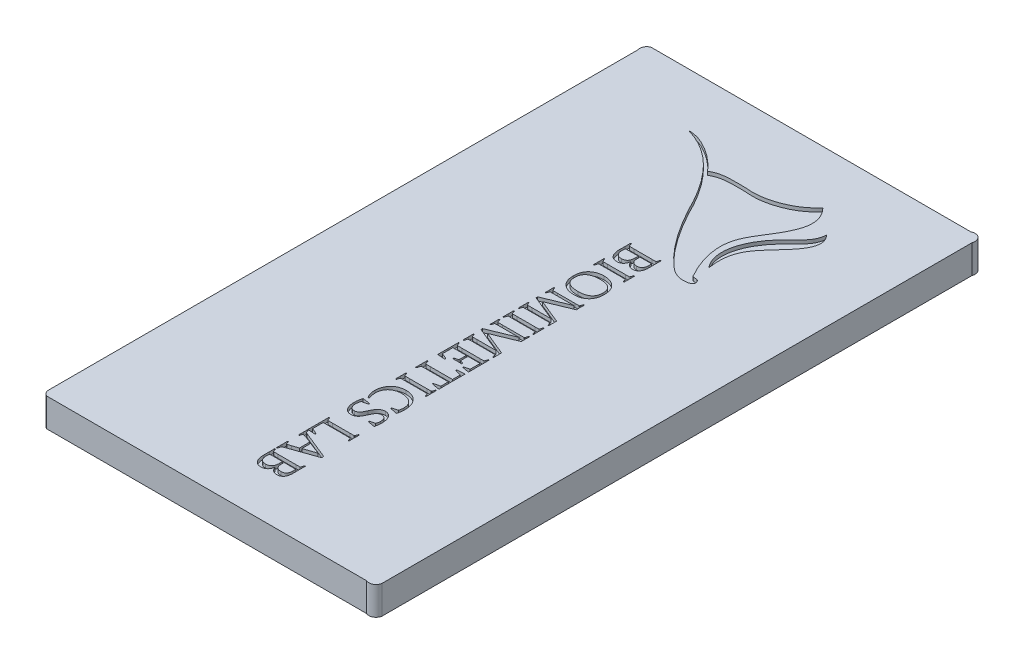
from build123d import *

# Parameters (mm, degrees)
SKETCH1_W           = 36.8
SKETCH1_H           = 74.5
BOSS_EXTRUDE1_DEPTH = 4
SKETCH1_3_W         = 36.8
SKETCH1_3_H         = 74.5
BOSS_EXTRUDE2_DEPTH = 4
SKETCH2_W           = 32.5
SKETCH2_H           = 70
CUT_EXTRUDE1_DEPTH  = 5
SKETCH2_3_W         = 11
SKETCH2_3_H         = 2
CUT_EXTRUDE2_DEPTH  = 4
FILLET1_R           = 1
CUT_EXTRUDE3_DEPTH  = 0.5
SKETCH4_W           = 2.55
SKETCH4_H           = 25
CUT_EXTRUDE4_DEPTH  = 4


with BuildPart() as part:
    # Sketch1 → Boss-Extrude1 (new body)
    # profile 1 of 2: a face of its own
    with BuildSketch(Plane(origin=(0, 0, 0), x_dir=(1, 0, 0), z_dir=(0, 1, 0))):
        with BuildLine():
            Line((-22.5, -42.25), (22.5, -42.25))
            ThreePointArc((22.5, -42.25), (23.385223046, -42.220749686), (23.9, -41.5))
            Line((23.9, -41.5), (23.9, 41.5))
            ThreePointArc((23.9, 41.5), (23.635902743, 42.613211072), (22.5, 42.75))
            Line((22.5, 42.75), (-22.5, 42.75))
            ThreePointArc((-22.5, 42.75), (-23.051816337, 42.245871842), (-23.1, 41.5))
            Line((-23.1, 41.5), (-23.1, -41.5))
            ThreePointArc((-23.1, -41.5), (-22.895937355, -41.951749884), (-22.5, -42.25))
        make_face()
        with Locations((0.4, 0.25)):
            Rectangle(SKETCH1_W, SKETCH1_H, mode=Mode.SUBTRACT)
    # profile 2 of 2: a face of its own
    with BuildSketch(Plane(origin=(0, 0, 0), x_dir=(1, 0, 0), z_dir=(0, 1, 0))):
        with Locations((0.4, 0.25)):
            Rectangle(SKETCH1_W, SKETCH1_H)
    extrude(amount=BOSS_EXTRUDE1_DEPTH)

    # Sketch1<3> → Boss-Extrude2 (add)
    with BuildSketch(Plane(origin=(0, 0, 0), x_dir=(1, 0, 0), z_dir=(0, 1, 0))):
        with Locations((0.4, 0.25)):
            Rectangle(SKETCH1_3_W, SKETCH1_3_H)
    extrude(amount=-BOSS_EXTRUDE2_DEPTH)

    # Sketch2 → Cut-Extrude1 (cut)
    with BuildSketch(Plane.XZ.offset(4)):
        Rectangle(SKETCH2_W, SKETCH2_H)
    extrude(amount=-CUT_EXTRUDE1_DEPTH, mode=Mode.SUBTRACT)

    # Sketch2<3> → Cut-Extrude2 (cut)
    with BuildSketch(Plane.XZ.offset(4)):
        with Locations((0, 36)):
            Rectangle(SKETCH2_3_W, SKETCH2_3_H)
    extrude(amount=-CUT_EXTRUDE2_DEPTH, mode=Mode.SUBTRACT)

    # Fillet1
    fillet1_edges = [part.edges().sort_by_distance(p)[0] for p in [
        (-18, -2, -37.5),
        (18.8, -2, -37.5),
        (18.8, -2, 37),
        (-18, -2, 37),
        (16.25, -1.5, 35),
        (16.25, -1.5, -35),
        (-16.25, -1.5, -35),
        (-16.25, -1.5, 35),
        (5.5, -2, 37),
        (-5.5, -2, 37),
    ]]
    fillet(fillet1_edges, radius=FILLET1_R)

    # Sketch3 → Cut-Extrude3 (cut)
    # profile 1 of 16: a face of its own
    with BuildSketch(Plane(origin=(0, 4, 0), x_dir=(1, 0, 0), z_dir=(0, 1, 0))):
        with BuildLine():
            add(Edge.make_bspline(
                [(9.156830475, 35.259856068), (8.003127701, 33.91320588), (5.583039895, 32.588430043), (2.639385768, 32.137956391), (1.178873908, 32.300242613), (-0.637102053, 32.256532565), (-2.215908644, 32.356186131), (-3.394865346, 31.61862131)],
                knots=[0, 0, 0, 0, 0.388867236, 0.595687319, 0.651023537, 0.71543679, 1, 1, 1, 1], degree=3))
            add(Edge.make_bspline(
                [(-3.394865346, 31.61862131), (-4.301897237, 32.657245572), (-6.220418115, 34.280795484), (-8.585647545, 35.273887291), (-9.750550966, 35.259856068)],
                knots=[0, 0, 0, 0, 0.54571838, 1, 1, 1, 1], degree=3))
            add(Edge.make_bspline(
                [(-9.750550966, 35.259856068), (-5.042461481, 34.018214976), (-2.006486605, 29.608605902), (0, 25.487768974)],
                knots=[0, 0, 0, 0, 1, 1, 1, 1], degree=3))
            add(Edge.make_bspline(
                [(0, 25.487768974), (1.516415458, 22.731402407), (3.779862943, 19.191002948), (7.45866886, 16.284920894), (9.534589293, 16.822136971), (9.151155899, 17.952843633), (8.367593739, 17.524373099), (8.245122308, 18.033813362)],
                knots=[0, 0, 0, 0, 0.617672319, 0.826885425, 0.894882562, 0.931266081, 1, 1, 1, 1], degree=3))
            add(Edge.make_bspline(
                [(8.245122308, 18.033813362), (7.143333491, 19.927957501), (5.804965403, 24.028536973), (9.27907206, 29.212663209), (11.385318618, 33.028675889), (9.156830475, 35.259856068)],
                knots=[0, 0, 0, 0, 0.37407968, 0.590963574, 1, 1, 1, 1], degree=3))
        make_face()
    # profile 2 of 16: a face of its own
    with BuildSketch(Plane(origin=(0, 4, 0), x_dir=(1, 0, 0), z_dir=(0, 1, 0))):
        with BuildLine():
            add(Edge.make_bspline(
                [(12.709008701, 32.22712186), (12.720495304, 30.941176848), (11.301560478, 29.599657911), (9.331765433, 27.623418329), (7.382696511, 24.646211029), (7.117974935, 21.533878708), (8.435332039, 19.954411657)],
                knots=[0, 0, 0, 0, 0.249686107, 0.397227371, 0.59923911, 1, 1, 1, 1], degree=3))
            add(Edge.make_bspline(
                [(12.709008701, 32.22712186), (14.093449014, 30.856200716), (11.072233674, 26.198559169), (7.745998202, 24.204595683), (8.435332039, 19.954411657)],
                knots=[0, 0, 0, 0, 0.348722031, 1, 1, 1, 1], degree=3))
        make_face()
    # profile 3 of 16: a face of its own
    with BuildSketch(Plane(origin=(0, 4, 0), x_dir=(1, 0, 0), z_dir=(0, 1, 0))):
        with BuildLine():
            add(Edge.make_bspline(
                [(4.242666667, -32.617104167), (4.239157574, -32.746096277), (4.232180847, -33.002556534), (4.23140597, -33.259110351), (4.231020833, -33.386625)],
                knots=[0, 0, 0, 0, 1.005942301, 2, 2, 2, 2], degree=3))
            add(Edge.make_bspline(
                [(4.231020833, -33.386625), (4.232013679, -33.414393418), (4.234265789, -33.477381624), (4.23552816, -33.582813441), (4.237519156, -33.710614626), (4.23895058, -33.852459869), (4.241048455, -33.992502501), (4.241505805, -34.114342193), (4.242846247, -34.210192151), (4.242719925, -34.265437234), (4.242666667, -34.288729167)],
                knots=[0, 0, 0, 0, 0.739130462, 1.676598976, 2.804688918, 4.139292743, 5.450067765, 6.530413991, 7.380406414, 8, 8, 8, 8], degree=3))
            add(Edge.make_bspline(
                [(4.242666667, -34.288729167), (4.242196749, -34.343403892), (4.241286364, -34.449326813), (4.22808793, -34.603017541), (4.208609838, -34.746577222), (4.182644581, -34.880469196), (4.146447123, -35.003398551), (4.103666891, -35.116368561), (4.05275545, -35.218966773), (3.993516321, -35.310939929), (3.926560379, -35.391855247), (3.854146012, -35.463958731), (3.772664835, -35.523033417), (3.684959013, -35.571571468), (3.590957666, -35.611118344), (3.489212757, -35.63712983), (3.380832736, -35.653857385), (3.306287991, -35.655713382), (3.268, -35.656666667)],
                knots=[0, 0, 0, 0, 1.378276236, 2.670174251, 3.886272191, 5.030722253, 6.105370442, 7.113600151, 8.073313012, 8.98810981, 9.865448682, 10.717410964, 11.557781383, 12.393721025, 13.241112429, 14.1214512, 15.035131711, 16, 16, 16, 16], degree=3))
            add(Edge.make_bspline(
                [(3.268, -35.656666667), (3.236906659, -35.656365617), (3.176045085, -35.655776347), (3.086689765, -35.644795723), (3.000689516, -35.630730799), (2.918994378, -35.607352441), (2.840441107, -35.580527968), (2.766907452, -35.54433628), (2.695479765, -35.504955495), (2.629582733, -35.456489324), (2.565879964, -35.404050531), (2.508278271, -35.342986926), (2.452129365, -35.278037766), (2.400917566, -35.205551714), (2.353892696, -35.126807186), (2.309594529, -35.042010511), (2.269352435, -34.951079637), (2.246643293, -34.887302642), (2.235104167, -34.854895833)],
                knots=[0, 0, 0, 0, 1.057010299, 2.068973867, 3.05944387, 4.018196596, 4.956492417, 5.878980143, 6.802641909, 7.727364617, 8.657429372, 9.605791154, 10.578809353, 11.576753923, 12.620399978, 13.697337371, 14.829955113, 16, 16, 16, 16], degree=3))
            add(Edge.make_bspline(
                [(2.235104167, -34.854895833), (2.228183398, -34.892938527), (2.214622238, -34.967482705), (2.185540544, -35.074776365), (2.151926486, -35.175639183), (2.111397636, -35.269422055), (2.06458946, -35.356393841), (2.012886132, -35.437516278), (1.954428736, -35.511441943), (1.889656517, -35.577448813), (1.820692383, -35.637322864), (1.746144909, -35.688124162), (1.66727751, -35.73162814), (1.584106159, -35.7678023), (1.495513163, -35.794277726), (1.402653246, -35.81394221), (1.305307225, -35.827143672), (1.238682575, -35.828154205), (1.204895833, -35.828666667)],
                knots=[0, 0, 0, 0, 1.187691737, 2.327266932, 3.412498183, 4.452284031, 5.462165349, 6.444620124, 7.404753811, 8.352131345, 9.282696159, 10.206586917, 11.118322801, 12.047257586, 12.987677541, 13.954104388, 14.962483898, 16, 16, 16, 16], degree=3))
            add(Edge.make_bspline(
                [(1.204895833, -35.828666667), (1.156148261, -35.827280753), (1.060889862, -35.824572518), (0.922026108, -35.803689479), (0.791368718, -35.769074153), (0.669609121, -35.719385946), (0.556339435, -35.656112459), (0.451665117, -35.578634096), (0.356496211, -35.486097409), (0.269313154, -35.381215988), (0.19267786, -35.263266416), (0.125096786, -35.134760215), (0.068813963, -34.994729158), (0.02234439, -34.844323773), (-0.013107159, -34.683042727), (-0.039151643, -34.511306089), (-0.054156301, -34.32871236), (-0.056257014, -34.203353679), (-0.057333333, -34.139125)],
                knots=[0, 0, 0, 0, 0.981875571, 1.918698485, 2.822100722, 3.699153801, 4.56111555, 5.429916463, 6.314981201, 7.229375688, 8.172207148, 9.143723783, 10.150374691, 11.208464006, 12.311985658, 13.474314099, 14.705941473, 16, 16, 16, 16], degree=3))
            add(Edge.make_bspline(
                [(-0.057333333, -34.139125), (-0.057236308, -34.084476518), (-0.057034283, -33.970688989), (-0.052594507, -33.791845256), (-0.048495687, -33.595372602), (-0.048416602, -33.457995825), (-0.048375, -33.385729167)],
                knots=[0, 0, 0, 0, 0.870320638, 1.812157107, 2.849091541, 4, 4, 4, 4], degree=3))
            add(Edge.make_bspline(
                [(-0.048375, -33.385729167), (-0.04853788, -33.260605996), (-0.04886639, -33.008248312), (-0.054495321, -32.755953045), (-0.057333333, -32.62875)],
                knots=[0, 0, 0, 0, 0.991633528, 2, 2, 2, 2], degree=3))
            Line((-0.057333333, -32.62875), (0.057333333, -32.617104167))
            Line((0.057333333, -32.617104167), (0.172, -32.988875))
            add(Edge.make_bspline(
                [(0.172, -32.988875), (0.176149969, -33.000245715), (0.184030297, -33.02183743), (0.205407478, -33.048220859), (0.234205206, -33.065823651), (0.256254788, -33.068819723), (0.267854167, -33.070395833)],
                knots=[0, 0, 0, 0, 1.072356029, 2.036284212, 2.966969876, 4, 4, 4, 4], degree=3))
            add(Edge.make_bspline(
                [(0.267854167, -33.070395833), (0.311450064, -33.071363785), (0.403412968, -33.07340562), (0.549141743, -33.075115308), (0.710395903, -33.075759593), (0.823270907, -33.07635486), (0.882395833, -33.076666667)],
                knots=[0, 0, 0, 0, 0.851431499, 1.796043159, 2.845547889, 4, 4, 4, 4], degree=3))
            Line((0.882395833, -33.076666667), (3.3889375, -33.076666667))
            add(Edge.make_bspline(
                [(3.3889375, -33.076666667), (3.438805476, -33.076355815), (3.53346524, -33.075765753), (3.668442365, -33.075113056), (3.789686582, -33.073413618), (3.866119663, -33.071364475), (3.90225, -33.070395833)],
                knots=[0, 0, 0, 0, 1.165696311, 2.212733421, 3.155149283, 4, 4, 4, 4], degree=3))
            add(Edge.make_bspline(
                [(3.90225, -33.070395833), (3.914701462, -33.069429791), (3.938173297, -33.067608738), (3.969236134, -33.052080975), (3.994221867, -33.029164307), (4.002708069, -33.008458088), (4.0070625, -32.997833333)],
                knots=[0, 0, 0, 0, 1.089053236, 2.052937975, 3.000925474, 4, 4, 4, 4], degree=3))
            Line((4.0070625, -32.997833333), (4.128, -32.623375))
            Line((4.128, -32.623375), (4.242666667, -32.617104167))
        make_face()
        with BuildLine():
            Line((2.064, -33.65), (0.2795, -33.65))
            add(Edge.make_bspline(
                [(0.2795, -33.65), (0.269952617, -33.683256097), (0.249667723, -33.753913826), (0.23702719, -33.865895798), (0.231620745, -33.97929884), (0.2300749, -34.054012689), (0.229333333, -34.089854167)],
                knots=[0, 0, 0, 0, 0.932947293, 1.982191065, 3.032023438, 4, 4, 4, 4], degree=3))
            add(Edge.make_bspline(
                [(0.229333333, -34.089854167), (0.229902402, -34.131391076), (0.2310102, -34.212250286), (0.242985671, -34.329590738), (0.261671255, -34.43947851), (0.287116046, -34.541962313), (0.321371339, -34.636362868), (0.362617542, -34.723375157), (0.411993137, -34.802372978), (0.46869036, -34.873727751), (0.532761399, -34.936889448), (0.603685649, -34.991734823), (0.681714951, -35.037848786), (0.766301239, -35.075265372), (0.857418045, -35.105286023), (0.955745095, -35.125300243), (1.06062921, -35.138086566), (1.132891428, -35.13979191), (1.169958333, -35.140666667)],
                knots=[0, 0, 0, 0, 1.238057209, 2.410105338, 3.512269806, 4.559560237, 5.553733266, 6.501495605, 7.425414509, 8.325034372, 9.212724115, 10.101350968, 10.991537483, 11.9081781, 12.854182454, 13.846000613, 14.895105975, 16, 16, 16, 16], degree=3))
            add(Edge.make_bspline(
                [(1.169958333, -35.140666667), (1.207027989, -35.139805626), (1.278998995, -35.138133908), (1.382972926, -35.125309377), (1.480031743, -35.105555344), (1.568746796, -35.074267433), (1.651367864, -35.037095553), (1.725971747, -34.990225951), (1.793190216, -34.934917475), (1.853090946, -34.870614018), (1.904970558, -34.796072607), (1.951377942, -34.712407149), (1.988061317, -34.617406478), (2.019868266, -34.513026234), (2.043267757, -34.397771457), (2.061505035, -34.272513337), (2.070753658, -34.136576184), (2.072205513, -34.042684814), (2.072958333, -33.994)],
                knots=[0, 0, 0, 0, 1.059832066, 2.057671665, 2.992334016, 3.88627413, 4.742202784, 5.57865246, 6.397655829, 7.225516418, 8.083275119, 8.989088759, 9.954874721, 10.989636585, 12.106823062, 13.314574582, 14.607545775, 16, 16, 16, 16], degree=3))
            add(Edge.make_bspline(
                [(2.072958333, -33.994), (2.072834559, -33.935758389), (2.072590717, -33.82101964), (2.0668344, -33.70642579), (2.064, -33.65)],
                knots=[0, 0, 0, 0, 1.015203882, 2, 2, 2, 2], degree=3))
        make_face(mode=Mode.SUBTRACT)
        with BuildLine():
            add(Edge.make_bspline(
                [(2.296020833, -33.65), (2.295348299, -33.71449948), (2.2939908, -33.844690738), (2.293553823, -33.97488835), (2.293333333, -34.040583333)],
                knots=[0, 0, 0, 0, 0.990841954, 2, 2, 2, 2], degree=3))
            add(Edge.make_bspline(
                [(2.293333333, -34.040583333), (2.294075053, -34.077630757), (2.295519343, -34.149770117), (2.305106516, -34.25433017), (2.322072488, -34.352042818), (2.346226005, -34.442525009), (2.37656424, -34.526298867), (2.413519738, -34.603282001), (2.457071568, -34.6735135), (2.508804639, -34.735655085), (2.566450224, -34.79076911), (2.630555568, -34.838555241), (2.700970267, -34.878977955), (2.777209069, -34.912298138), (2.860057903, -34.937092139), (2.948350642, -34.956077914), (3.043185845, -34.96669754), (3.108217704, -34.967997579), (3.1416875, -34.968666667)],
                knots=[0, 0, 0, 0, 1.23699129, 2.408690005, 3.502046167, 4.544433668, 5.53171952, 6.472656332, 7.391084167, 8.283434464, 9.164968673, 10.048361651, 10.946209537, 11.870517701, 12.81981669, 13.828863933, 14.882586448, 16, 16, 16, 16], degree=3))
            add(Edge.make_bspline(
                [(3.1416875, -34.968666667), (3.176662772, -34.968121679), (3.24413697, -34.96707029), (3.341526218, -34.95501097), (3.431508507, -34.936414827), (3.51444486, -34.910912396), (3.589327983, -34.876688438), (3.656335116, -34.835009076), (3.716410639, -34.786615549), (3.767608281, -34.729039091), (3.812417549, -34.665169216), (3.851366656, -34.594655473), (3.883085761, -34.51715916), (3.910421934, -34.433452856), (3.930368469, -34.342747237), (3.945753925, -34.245867553), (3.954766941, -34.142282502), (3.955580336, -34.071059382), (3.956, -34.0343125)],
                knots=[0, 0, 0, 0, 1.177020335, 2.270704385, 3.298047452, 4.26789313, 5.185686968, 6.061724163, 6.919100279, 7.773287137, 8.646376941, 9.541871958, 10.4792274, 11.461706663, 12.503170771, 13.602386429, 14.762974373, 16, 16, 16, 16], degree=3))
            add(Edge.make_bspline(
                [(3.956, -34.0343125), (3.955876664, -34.006238915), (3.955618088, -33.947382401), (3.951585118, -33.855098834), (3.945956635, -33.75492997), (3.938409429, -33.685806002), (3.9345, -33.65)],
                knots=[0, 0, 0, 0, 0.874671488, 1.833756295, 2.877892474, 4, 4, 4, 4], degree=3))
            Line((3.9345, -33.65), (2.296020833, -33.65))
        make_face(mode=Mode.SUBTRACT)
    # profile 4 of 16: a face of its own
    with BuildSketch(Plane(origin=(0, 4, 0), x_dir=(1, 0, 0), z_dir=(0, 1, 0))):
        with BuildLine():
            Line((4.357333333, -30.425895833), (0.549145833, -31.767854167))
            add(Edge.make_bspline(
                [(0.549145833, -31.767854167), (0.516114472, -31.779643531), (0.45511349, -31.801415651), (0.373922528, -31.837692653), (0.308352802, -31.8694879), (0.259059067, -31.90324738), (0.220508885, -31.939214361), (0.190313664, -31.981333423), (0.16392426, -32.029113069), (0.150939814, -32.06417229), (0.144229167, -32.082291667)],
                knots=[0, 0, 0, 0, 1.569410788, 2.898324298, 3.980546281, 4.82607091, 5.563666975, 6.328387796, 7.136074064, 8, 8, 8, 8], degree=3))
            Line((0.144229167, -32.082291667), (0.057333333, -32.367166667))
            Line((0.057333333, -32.367166667), (-0.057333333, -32.372541667))
            add(Edge.make_bspline(
                [(-0.057333333, -32.372541667), (-0.056219708, -32.307741999), (-0.0540335, -32.180530765), (-0.0494407, -31.993325149), (-0.049465075, -31.813240852), (-0.048733406, -31.695589574), (-0.048375, -31.637958333)],
                knots=[0, 0, 0, 0, 1.058612849, 2.078212005, 3.058616038, 4, 4, 4, 4], degree=3))
            add(Edge.make_bspline(
                [(-0.048375, -31.637958333), (-0.048730367, -31.577938081), (-0.049472923, -31.452522756), (-0.049471575, -31.256913332), (-0.054122509, -31.045817406), (-0.056237067, -30.900091477), (-0.057333333, -30.824541667)],
                knots=[0, 0, 0, 0, 0.885404837, 1.850097777, 2.88540972, 4, 4, 4, 4], degree=3))
            Line((-0.057333333, -30.824541667), (0.057333333, -30.812895833))
            Line((0.057333333, -30.812895833), (0.1478125, -31.0995625))
            add(Edge.make_bspline(
                [(0.1478125, -31.0995625), (0.155285798, -31.117068816), (0.16843626, -31.147873974), (0.194533667, -31.188608818), (0.236832659, -31.209436639), (0.267634986, -31.210786277), (0.284875, -31.211541667)],
                knots=[0, 0, 0, 0, 1.189251438, 2.0926778, 2.932474793, 4, 4, 4, 4], degree=3))
            add(Edge.make_bspline(
                [(0.284875, -31.211541667), (0.310065291, -31.209533658), (0.367799339, -31.20493147), (0.443257663, -31.184319495), (0.515077597, -31.161330489), (0.580940065, -31.14090171), (0.655092849, -31.116401195), (0.707694455, -31.099520647), (0.735479167, -31.090604167)],
                knots=[0, 0, 0, 0, 0.97064759, 2.224643368, 2.995044448, 3.874428157, 4.877250996, 6, 6, 6, 6], degree=3))
            Line((0.735479167, -31.090604167), (1.605333333, -30.806625))
            Line((1.605333333, -30.806625), (1.605333333, -29.349104167))
            Line((1.605333333, -29.349104167), (0.735479167, -29.031979167))
            add(Edge.make_bspline(
                [(0.735479167, -29.031979167), (0.70655118, -29.021717898), (0.652080424, -29.002396156), (0.574442025, -28.976688472), (0.506774664, -28.953354202), (0.447791777, -28.933204485), (0.396602392, -28.916761047), (0.351625609, -28.904444392), (0.311920324, -28.898136759), (0.287278519, -28.896545978), (0.275916667, -28.8958125)],
                knots=[0, 0, 0, 0, 1.53240931, 2.885492703, 4.083024932, 5.106092639, 5.997254392, 6.767473552, 7.431706304, 8, 8, 8, 8], degree=3))
            add(Edge.make_bspline(
                [(0.275916667, -28.8958125), (0.259410469, -28.896738116), (0.229057833, -28.898440197), (0.189536365, -28.923129688), (0.163329335, -28.962649983), (0.151601283, -28.993463697), (0.145125, -29.010479167)],
                knots=[0, 0, 0, 0, 1.036269142, 1.905557071, 2.843439335, 4, 4, 4, 4], degree=3))
            Line((0.145125, -29.010479167), (0.057333333, -29.291770833))
            Line((0.057333333, -29.291770833), (-0.057333333, -29.298041667))
            add(Edge.make_bspline(
                [(-0.057333333, -29.298041667), (-0.056253482, -29.22965808), (-0.0542022, -29.099756916), (-0.049510667, -28.914644322), (-0.049478919, -28.749192288), (-0.048727131, -28.645277164), (-0.048375, -28.596604167)],
                knots=[0, 0, 0, 0, 1.169919131, 2.222373308, 3.16737414, 4, 4, 4, 4], degree=3))
            add(Edge.make_bspline(
                [(-0.048375, -28.596604167), (-0.048733217, -28.550021671), (-0.049472614, -28.45387074), (-0.049438079, -28.306031819), (-0.054078661, -28.150186294), (-0.056228325, -28.04387645), (-0.057333333, -27.989229167)],
                knots=[0, 0, 0, 0, 0.920242369, 1.899472282, 2.920249249, 4, 4, 4, 4], degree=3))
            Line((-0.057333333, -27.989229167), (0.057333333, -27.974))
            Line((0.057333333, -27.974), (0.154083333, -28.279479167))
            add(Edge.make_bspline(
                [(0.154083333, -28.279479167), (0.160274262, -28.29770745), (0.172165906, -28.332720656), (0.200162614, -28.378303355), (0.230449887, -28.418508948), (0.269203907, -28.450815918), (0.316157055, -28.47833136), (0.370971613, -28.508620012), (0.437760929, -28.538195774), (0.48581921, -28.558741362), (0.511520833, -28.569729167)],
                knots=[0, 0, 0, 0, 0.960148125, 1.844269422, 2.663371514, 3.46886791, 4.347924019, 5.384230788, 6.601083615, 8, 8, 8, 8], degree=3))
            Line((0.511520833, -28.569729167), (4.31075, -30.114145833))
            Line((4.31075, -30.114145833), (4.357333333, -30.425895833))
        make_face()
        Polygon((1.834666667, -29.461083333), (1.834666667, -30.7071875), (3.5448125, -30.117729167), align=None, mode=Mode.SUBTRACT)
    # profile 5 of 16: a face of its own
    with BuildSketch(Plane(origin=(0, 4, 0), x_dir=(1, 0, 0), z_dir=(0, 1, 0))):
        with BuildLine():
            Line((3.3943125, -26.024666667), (0.855520833, -26.024666667))
            add(Edge.make_bspline(
                [(0.855520833, -26.024666667), (0.740852047, -26.025033543), (0.512999245, -26.025762544), (0.285171546, -26.029220025), (0.172, -26.0309375)],
                knots=[0, 0, 0, 0, 1.006516356, 2, 2, 2, 2], degree=3))
            Line((0.172, -26.0309375), (0.172, -27.5036875))
            Line((0.172, -27.5036875), (1.009604167, -27.8906875))
            Line((1.009604167, -27.8906875), (1.032, -28.026854167))
            Line((1.032, -28.026854167), (-0.0456875, -27.959666667))
            Line((-0.0456875, -27.959666667), (-0.066291667, -27.94175))
            add(Edge.make_bspline(
                [(-0.066291667, -27.94175), (-0.065179332, -27.813645286), (-0.062998739, -27.562511819), (-0.058399011, -27.193141887), (-0.058423614, -26.838380826), (-0.05769173, -26.606659365), (-0.057333333, -26.4931875)],
                knots=[0, 0, 0, 0, 1.061243945, 2.080437664, 3.060008003, 4, 4, 4, 4], degree=3))
            Line((-0.057333333, -26.4931875), (-0.057333333, -25.744270833))
            add(Edge.make_bspline(
                [(-0.057333333, -25.744270833), (-0.057333333, -25.623034722), (-0.057333333, -25.376083333), (-0.057333333, -25.129131944), (-0.057333333, -25.003416667)],
                knots=[0, 0, 0, 0, 0.981862152, 2, 2, 2, 2], degree=3))
            Line((-0.057333333, -25.003416667), (0.057333333, -24.991770833))
            Line((0.057333333, -24.991770833), (0.172, -25.363541667))
            add(Edge.make_bspline(
                [(0.172, -25.363541667), (0.176149969, -25.374912381), (0.184030297, -25.396504097), (0.205407478, -25.422887525), (0.234205206, -25.440490318), (0.256254788, -25.44348639), (0.267854167, -25.4450625)],
                knots=[0, 0, 0, 0, 1.072356029, 2.036284212, 2.966969876, 4, 4, 4, 4], degree=3))
            add(Edge.make_bspline(
                [(0.267854167, -25.4450625), (0.311450064, -25.446030451), (0.403412968, -25.448072287), (0.549141743, -25.449781974), (0.710395903, -25.450426259), (0.823270907, -25.451021527), (0.882395833, -25.451333333)],
                knots=[0, 0, 0, 0, 0.851431499, 1.796043159, 2.845547889, 4, 4, 4, 4], degree=3))
            Line((0.882395833, -25.451333333), (3.3889375, -25.451333333))
            add(Edge.make_bspline(
                [(3.3889375, -25.451333333), (3.438805476, -25.451022481), (3.53346524, -25.45043242), (3.668442365, -25.449779722), (3.789686582, -25.448080285), (3.866119663, -25.446031141), (3.90225, -25.4450625)],
                knots=[0, 0, 0, 0, 1.165696311, 2.212733421, 3.155149283, 4, 4, 4, 4], degree=3))
            add(Edge.make_bspline(
                [(3.90225, -25.4450625), (3.914701462, -25.444096458), (3.938173297, -25.442275405), (3.969236134, -25.426747642), (3.994221867, -25.403830974), (4.002708069, -25.383124755), (4.0070625, -25.3725)],
                knots=[0, 0, 0, 0, 1.089053236, 2.052937975, 3.000925474, 4, 4, 4, 4], degree=3))
            Line((4.0070625, -25.3725), (4.128, -24.998041667))
            Line((4.128, -24.998041667), (4.242666667, -24.991770833))
            add(Edge.make_bspline(
                [(4.242666667, -24.991770833), (4.239156648, -25.118373812), (4.232319566, -25.364980718), (4.231445952, -25.611680193), (4.231020833, -25.731729167)],
                knots=[0, 0, 0, 0, 1.026759394, 2, 2, 2, 2], degree=3))
            add(Edge.make_bspline(
                [(4.231020833, -25.731729167), (4.231439102, -25.852375473), (4.232295419, -26.099373857), (4.239156751, -26.346278969), (4.242666667, -26.472583333)],
                knots=[0, 0, 0, 0, 0.976899564, 2, 2, 2, 2], degree=3))
            Line((4.242666667, -26.472583333), (4.128, -26.484229167))
            Line((4.128, -26.484229167), (4.0124375, -26.109770833))
            add(Edge.make_bspline(
                [(4.0124375, -26.109770833), (4.008572749, -26.098743352), (4.001256661, -26.077868004), (3.980502436, -26.051194147), (3.950006765, -26.036003633), (3.927480413, -26.032678344), (3.9156875, -26.0309375)],
                knots=[0, 0, 0, 0, 1.040863571, 1.970385419, 2.937463555, 4, 4, 4, 4], degree=3))
            add(Edge.make_bspline(
                [(3.9156875, -26.0309375), (3.895380716, -26.030703464), (3.850581707, -26.030187155), (3.777145243, -26.027794282), (3.691130106, -26.027429948), (3.599459159, -26.026400071), (3.514948116, -26.025887208), (3.451051815, -26.024511627), (3.413722172, -26.024673539), (3.397895824, -26.024667935), (3.3943125, -26.024666667)],
                knots=[0, 0, 0, 0, 0.934723227, 2.062102789, 3.381640966, 4.893592245, 6.281849097, 7.271544485, 7.835066676, 8, 8, 8, 8], degree=3))
        make_face()
    # profile 6 of 16: a face of its own
    with BuildSketch(Plane(origin=(0, 4, 0), x_dir=(1, 0, 0), z_dir=(0, 1, 0))):
        with BuildLine():
            add(Edge.make_bspline(
                [(3.967645833, -22.436854167), (3.983361578, -22.385399632), (4.013986307, -22.285131959), (4.045582986, -22.135593615), (4.067038491, -21.992544951), (4.069479009, -21.89912749), (4.070666667, -21.853666667)],
                knots=[0, 0, 0, 0, 1.085488502, 2.115253907, 3.082804142, 4, 4, 4, 4], degree=3))
            add(Edge.make_bspline(
                [(4.070666667, -21.853666667), (4.070270159, -21.821092468), (4.06949735, -21.757604122), (4.060044319, -21.665173633), (4.046182108, -21.577610166), (4.025357659, -21.495341452), (3.999807133, -21.417699168), (3.966951419, -21.345773035), (3.929740808, -21.278060965), (3.885619686, -21.216634075), (3.837418871, -21.16040467), (3.783666878, -21.112154989), (3.725221398, -21.071140467), (3.662841113, -21.037176945), (3.595533544, -21.010521064), (3.523348746, -20.993519657), (3.447004964, -20.980921021), (3.394368585, -20.979870716), (3.3674375, -20.979333333)],
                knots=[0, 0, 0, 0, 1.234208642, 2.405519354, 3.51827187, 4.591643104, 5.618907388, 6.611863802, 7.584813727, 8.542701907, 9.473318954, 10.386986489, 11.272527839, 12.174055887, 13.073663442, 14.007029733, 14.980308792, 16, 16, 16, 16], degree=3))
            add(Edge.make_bspline(
                [(3.3674375, -20.979333333), (3.334835275, -20.980393232), (3.271645019, -20.982447549), (3.179590617, -20.997599316), (3.094273464, -21.02484966), (3.014692272, -21.061523332), (2.942223688, -21.108721028), (2.871992626, -21.159891469), (2.809118553, -21.222017312), (2.727901075, -21.312165577), (2.638266401, -21.441849698), (2.544061584, -21.612085181), (2.456754126, -21.794203765), (2.400028385, -21.918671139), (2.371270833, -21.981770833)],
                knots=[0, 0, 0, 0, 0.778498901, 1.508901447, 2.21936171, 2.911694999, 3.594300334, 4.281768358, 4.982861087, 5.700054033, 7.178180949, 8.733234066, 10.343887846, 12, 12, 12, 12], degree=3))
            add(Edge.make_bspline(
                [(2.371270833, -21.981770833), (2.340028073, -22.050939698), (2.277834838, -22.188630329), (2.178371396, -22.389485852), (2.067637043, -22.579412399), (1.959038779, -22.722925972), (1.862081475, -22.82607357), (1.781791116, -22.894407868), (1.694412627, -22.954661173), (1.600167897, -23.006843878), (1.498450599, -23.049828634), (1.388044125, -23.078790004), (1.270010854, -23.09716854), (1.188543902, -23.099478999), (1.146666667, -23.100666667)],
                knots=[0, 0, 0, 0, 1.537959756, 3.061531377, 4.54035669, 5.986635101, 6.697125043, 7.405317871, 8.11868805, 8.844550121, 9.58511943, 10.349891542, 11.151778995, 12, 12, 12, 12], degree=3))
            add(Edge.make_bspline(
                [(1.146666667, -23.100666667), (1.096990803, -23.099540855), (1.000042524, -23.097343701), (0.859469796, -23.072924867), (0.727475771, -23.035806557), (0.604464039, -22.982559612), (0.490990524, -22.913683126), (0.385597402, -22.83092961), (0.291665558, -22.730753932), (0.205909271, -22.618108838), (0.13012479, -22.493600009), (0.064889446, -22.359570413), (0.009322704, -22.217538117), (-0.036574366, -22.06758087), (-0.071135738, -21.909308056), (-0.09609126, -21.742925674), (-0.111536286, -21.568186408), (-0.113608782, -21.448782098), (-0.114666667, -21.387833333)],
                knots=[0, 0, 0, 0, 0.995693307, 1.943212381, 2.853401529, 3.741575323, 4.623157416, 5.510178669, 6.421254701, 7.370287868, 8.346430534, 9.34050028, 10.357381684, 11.403528079, 12.483557003, 13.604551818, 14.777266867, 16, 16, 16, 16], degree=3))
            add(Edge.make_bspline(
                [(-0.114666667, -21.387833333), (-0.112428185, -21.305322827), (-0.107822844, -21.135569796), (-0.074334102, -20.875224096), (-0.022906527, -20.60219846), (0.026520956, -20.41825042), (0.051958333, -20.323583333)],
                knots=[0, 0, 0, 0, 0.91628578, 1.885120992, 2.911597897, 4, 4, 4, 4], degree=3))
            Line((0.051958333, -20.323583333), (0.076145833, -20.305666667))
            Line((0.076145833, -20.305666667), (1.125166667, -20.453479167))
            Line((1.125166667, -20.453479167), (1.146666667, -20.589645833))
            Line((1.146666667, -20.589645833), (0.297416667, -20.8010625))
            add(Edge.make_bspline(
                [(0.297416667, -20.8010625), (0.278183972, -20.854497156), (0.240003155, -20.960575837), (0.200902378, -21.124753459), (0.176899808, -21.290665557), (0.173631516, -21.402087193), (0.172, -21.457708333)],
                knots=[0, 0, 0, 0, 1.013176663, 2.01136215, 3.007281639, 4, 4, 4, 4], degree=3))
            add(Edge.make_bspline(
                [(0.172, -21.457708333), (0.172322382, -21.494167349), (0.172952572, -21.565437305), (0.183458225, -21.668894195), (0.19820758, -21.766583204), (0.219783751, -21.857546325), (0.24633875, -21.943022056), (0.280695198, -22.021595026), (0.319979951, -22.094805883), (0.365642055, -22.161471455), (0.417654216, -22.220399324), (0.474383665, -22.272338092), (0.537046584, -22.315393968), (0.604257712, -22.351914805), (0.677597729, -22.378252096), (0.755266692, -22.397997502), (0.83805116, -22.411241387), (0.895183312, -22.412183323), (0.9245, -22.412666667)],
                knots=[0, 0, 0, 0, 1.270049869, 2.482689028, 3.620494818, 4.711007824, 5.737888454, 6.735451087, 7.694768855, 8.63007701, 9.544481457, 10.428656228, 11.303409876, 12.188013278, 13.086948091, 14.010779637, 14.979255108, 16, 16, 16, 16], degree=3))
            add(Edge.make_bspline(
                [(0.9245, -22.412666667), (0.95650945, -22.41160771), (1.018815878, -22.409546449), (1.109250985, -22.394304835), (1.193461205, -22.368003862), (1.2718585, -22.331858369), (1.344438158, -22.287014515), (1.410927784, -22.234182838), (1.473411172, -22.176084492), (1.549498924, -22.086416661), (1.635566943, -21.959810404), (1.727588976, -21.79258301), (1.81336684, -21.613044144), (1.870320036, -21.490310216), (1.899166667, -21.428145833)],
                knots=[0, 0, 0, 0, 0.779227926, 1.516767949, 2.225092207, 2.921333849, 3.613462893, 4.297099235, 4.98635787, 5.687480169, 7.155824613, 8.70529872, 10.331243248, 12, 12, 12, 12], degree=3))
            add(Edge.make_bspline(
                [(1.899166667, -21.428145833), (1.9305488, -21.357712346), (1.992913026, -21.217743212), (2.095814165, -21.013916437), (2.211946733, -20.822080826), (2.323544177, -20.674873294), (2.425836884, -20.571400286), (2.509198675, -20.500480253), (2.602220864, -20.440166503), (2.702093299, -20.386454739), (2.810908051, -20.34304018), (2.929216683, -20.31289198), (3.056031671, -20.29493331), (3.143419324, -20.292554336), (3.188270833, -20.291333333)],
                knots=[0, 0, 0, 0, 1.505618682, 2.99204471, 4.455093308, 5.880379442, 6.585438146, 7.293192148, 8.012855622, 8.745836709, 9.504864235, 10.294022143, 11.124410826, 12, 12, 12, 12], degree=3))
            add(Edge.make_bspline(
                [(3.188270833, -20.291333333), (3.233461288, -20.292567384), (3.322036242, -20.29498617), (3.450789975, -20.31815137), (3.571860814, -20.354757803), (3.685125186, -20.406131475), (3.790000552, -20.473174668), (3.886303077, -20.555555927), (3.974496741, -20.652523753), (4.05447963, -20.762445922), (4.125318937, -20.882846949), (4.187426773, -21.010850808), (4.240097883, -21.145033959), (4.283503869, -21.285719002), (4.316139719, -21.432914192), (4.340514683, -21.586639056), (4.355010385, -21.746781167), (4.356551478, -21.855727388), (4.357333333, -21.911)],
                knots=[0, 0, 0, 0, 0.969817064, 1.900877145, 2.799633116, 3.680755418, 4.563230531, 5.464112223, 6.394708292, 7.372214391, 8.378664702, 9.391227115, 10.425016694, 11.471835048, 12.550108006, 13.660426542, 14.813044311, 16, 16, 16, 16], degree=3))
            add(Edge.make_bspline(
                [(4.357333333, -21.911), (4.355951431, -21.991676213), (4.35315221, -22.155096336), (4.330051719, -22.40258455), (4.296269712, -22.656125759), (4.261326516, -22.825527398), (4.2435625, -22.911645833)],
                knots=[0, 0, 0, 0, 0.959381208, 1.943350944, 2.954464664, 4, 4, 4, 4], degree=3))
            Line((4.2435625, -22.911645833), (4.221166667, -22.933145833))
            Line((4.221166667, -22.933145833), (3.259041667, -22.753979167))
            Line((3.259041667, -22.753979167), (3.237541667, -22.633041667))
            Line((3.237541667, -22.633041667), (3.967645833, -22.436854167))
        make_face()
    # profile 7 of 16: a face of its own
    with BuildSketch(Plane(origin=(0, 4, 0), x_dir=(1, 0, 0), z_dir=(0, 1, 0))):
        with BuildLine():
            Line((3.217833333, -19.5755625), (3.199020833, -19.454625))
            Line((3.199020833, -19.454625), (3.978395833, -19.233354167))
            add(Edge.make_bspline(
                [(3.978395833, -19.233354167), (3.992583829, -19.172585405), (4.020192632, -19.054333834), (4.048011097, -18.879504236), (4.067778401, -18.71362657), (4.069723614, -18.605727062), (4.070666667, -18.553416667)],
                knots=[0, 0, 0, 0, 1.088477901, 2.118098511, 3.087641701, 4, 4, 4, 4], degree=3))
            add(Edge.make_bspline(
                [(4.070666667, -18.553416667), (4.069309574, -18.493293722), (4.066657102, -18.375781829), (4.040356435, -18.204836339), (4.000855678, -18.043200806), (3.94321287, -17.891464303), (3.868033542, -17.75036556), (3.778384587, -17.618090745), (3.670147304, -17.497606529), (3.547766801, -17.387076204), (3.412497254, -17.287563788), (3.266058811, -17.20164722), (3.109955618, -17.128923273), (2.944744527, -17.068361269), (2.769019526, -17.023247341), (2.584248274, -16.990503853), (2.389698818, -16.968856498), (2.256664201, -16.966967558), (2.188520833, -16.966)],
                knots=[0, 0, 0, 0, 1.039883267, 2.032479486, 2.986404376, 3.915561767, 4.833409594, 5.748021293, 6.674256096, 7.629286435, 8.597883679, 9.575580315, 10.562860774, 11.574924783, 12.616655912, 13.698377388, 14.821056363, 16, 16, 16, 16], degree=3))
            add(Edge.make_bspline(
                [(2.188520833, -16.966), (2.115886133, -16.967138206), (1.973805269, -16.969364653), (1.766615685, -16.993688772), (1.570434934, -17.030481808), (1.385704342, -17.083624227), (1.212018317, -17.151448476), (1.050037664, -17.235579379), (0.898195055, -17.333132169), (0.75999203, -17.447083849), (0.634538861, -17.573399279), (0.526032024, -17.712829993), (0.433427115, -17.863701835), (0.35947726, -18.02682645), (0.300912984, -18.200908443), (0.25892697, -18.386638646), (0.233522678, -18.584062686), (0.230750948, -18.719665908), (0.229333333, -18.789020833)],
                knots=[0, 0, 0, 0, 1.150941887, 2.251359443, 3.302310505, 4.312135758, 5.294047232, 6.253145676, 7.201151829, 8.149736938, 9.087009725, 10.0178529, 10.944195404, 11.886808548, 12.85085921, 13.851085601, 14.900927299, 16, 16, 16, 16], degree=3))
            add(Edge.make_bspline(
                [(0.229333333, -18.789020833), (0.231451569, -18.870350029), (0.235758438, -19.035711306), (0.270140761, -19.286627503), (0.322923283, -19.544129059), (0.374860869, -19.715076718), (0.401333333, -19.802208333)],
                knots=[0, 0, 0, 0, 0.945703394, 1.922836208, 2.941274556, 4, 4, 4, 4], degree=3))
            Line((0.401333333, -19.802208333), (0.273229167, -19.835354167))
            add(Edge.make_bspline(
                [(0.273229167, -19.835354167), (0.242311033, -19.785321762), (0.18077212, -19.685738137), (0.102109361, -19.528895343), (0.034446711, -19.36745621), (-0.020156329, -19.200542208), (-0.062094147, -19.028854435), (-0.092822177, -18.852631444), (-0.110881345, -18.671448077), (-0.113396449, -18.548977206), (-0.114666667, -18.487125)],
                knots=[0, 0, 0, 0, 0.991626125, 1.973715307, 2.955869065, 3.941786668, 4.932491397, 5.934424837, 6.956810052, 8, 8, 8, 8], degree=3))
            add(Edge.make_bspline(
                [(-0.114666667, -18.487125), (-0.11267835, -18.407618521), (-0.108778961, -18.251694293), (-0.0810087, -18.023367694), (-0.033406469, -17.806251382), (0.032796593, -17.60069031), (0.117595488, -17.405970991), (0.221806788, -17.222806294), (0.345248815, -17.050787197), (0.486581251, -16.891924673), (0.642880293, -16.747698898), (0.812750541, -16.621628328), (0.995036839, -16.515538984), (1.188749777, -16.427802241), (1.395047102, -16.361019779), (1.61274205, -16.312593676), (1.842543246, -16.283568856), (1.999713996, -16.279884813), (2.080125, -16.278)],
                knots=[0, 0, 0, 0, 1.089457731, 2.136591363, 3.146380533, 4.131209356, 5.091449303, 6.051785163, 7.013671737, 7.987651678, 8.960754352, 9.923258772, 10.880590628, 11.845814079, 12.831908897, 13.846578502, 14.898276011, 16, 16, 16, 16], degree=3))
            add(Edge.make_bspline(
                [(2.080125, -16.278), (2.165626718, -16.28003188), (2.332450653, -16.283996319), (2.575794293, -16.315840593), (2.805536906, -16.36831328), (3.021471915, -16.442873109), (3.223913211, -16.538257258), (3.412396913, -16.655505444), (3.586935677, -16.794465277), (3.746949191, -16.953065493), (3.89044294, -17.127970761), (4.015839848, -17.316033664), (4.120906622, -17.516623354), (4.208422637, -17.728681592), (4.275469953, -17.953556785), (4.322475236, -18.19051163), (4.35177371, -18.439210358), (4.355455611, -18.609174601), (4.357333333, -18.695854167)],
                knots=[0, 0, 0, 0, 1.096575219, 2.139547583, 3.142210037, 4.11503178, 5.06436148, 6.007246349, 6.956112184, 7.920456891, 8.892131492, 9.853672068, 10.814991318, 11.792448224, 12.792318608, 13.820075352, 14.888266623, 16, 16, 16, 16], degree=3))
            add(Edge.make_bspline(
                [(4.357333333, -18.695854167), (4.355689025, -18.781606639), (4.352377375, -18.954312755), (4.328171084, -19.214562103), (4.289117591, -19.477813008), (4.251129688, -19.652792727), (4.231916667, -19.741291667)],
                knots=[0, 0, 0, 0, 0.975186661, 1.964033165, 2.970275485, 4, 4, 4, 4], degree=3))
            Line((4.231916667, -19.741291667), (4.206833333, -19.762791667))
            Line((4.206833333, -19.762791667), (3.217833333, -19.5755625))
        make_face()
    # profile 8 of 16: a face of its own
    with BuildSketch(Plane(origin=(0, 4, 0), x_dir=(1, 0, 0), z_dir=(0, 1, 0))):
        with BuildLine():
            add(Edge.make_bspline(
                [(0.882395833, -15.188666667), (0.823568319, -15.188478089), (0.711285058, -15.188118154), (0.55093834, -15.190547649), (0.405801448, -15.191865969), (0.314137402, -15.193947511), (0.270541667, -15.1949375)],
                knots=[0, 0, 0, 0, 1.15364162, 2.20193979, 3.144836395, 4, 4, 4, 4], degree=3))
            add(Edge.make_bspline(
                [(0.270541667, -15.1949375), (0.258183946, -15.196211266), (0.233887789, -15.198715582), (0.203584846, -15.22269796), (0.17922638, -15.256559736), (0.170522305, -15.284989954), (0.165729167, -15.300645833)],
                knots=[0, 0, 0, 0, 0.911394939, 1.791867202, 2.784031069, 4, 4, 4, 4], degree=3))
            Line((0.165729167, -15.300645833), (0.057333333, -15.642854167))
            Line((0.057333333, -15.642854167), (-0.057333333, -15.648229167))
            add(Edge.make_bspline(
                [(-0.057333333, -15.648229167), (-0.054492977, -15.521623437), (-0.048960087, -15.27500102), (-0.048566524, -15.028317336), (-0.048375, -14.908270833)],
                knots=[0, 0, 0, 0, 1.02671712, 2, 2, 2, 2], degree=3))
            add(Edge.make_bspline(
                [(-0.048375, -14.908270833), (-0.048553454, -14.787029712), (-0.048916985, -14.540046948), (-0.054494009, -14.293126556), (-0.057333333, -14.167416667)],
                knots=[0, 0, 0, 0, 0.98177799, 2, 2, 2, 2], degree=3))
            Line((-0.057333333, -14.167416667), (0.057333333, -14.155770833))
            Line((0.057333333, -14.155770833), (0.172, -14.527541667))
            add(Edge.make_bspline(
                [(0.172, -14.527541667), (0.176149969, -14.538912381), (0.184030297, -14.560504097), (0.205407478, -14.586887525), (0.234205206, -14.604490318), (0.256254788, -14.60748639), (0.267854167, -14.6090625)],
                knots=[0, 0, 0, 0, 1.072356029, 2.036284212, 2.966969876, 4, 4, 4, 4], degree=3))
            add(Edge.make_bspline(
                [(0.267854167, -14.6090625), (0.311450064, -14.610030451), (0.403412968, -14.612072287), (0.549141743, -14.613781974), (0.710395903, -14.614426259), (0.823270907, -14.615021527), (0.882395833, -14.615333333)],
                knots=[0, 0, 0, 0, 0.851431499, 1.796043159, 2.845547889, 4, 4, 4, 4], degree=3))
            Line((0.882395833, -14.615333333), (3.3889375, -14.615333333))
            add(Edge.make_bspline(
                [(3.3889375, -14.615333333), (3.438805476, -14.615022481), (3.53346524, -14.61443242), (3.668442365, -14.613779722), (3.789686582, -14.612080285), (3.866119663, -14.610031141), (3.90225, -14.6090625)],
                knots=[0, 0, 0, 0, 1.165696311, 2.212733421, 3.155149283, 4, 4, 4, 4], degree=3))
            add(Edge.make_bspline(
                [(3.90225, -14.6090625), (3.914701462, -14.608096458), (3.938173297, -14.606275405), (3.969236134, -14.590747642), (3.994221867, -14.567830974), (4.002708069, -14.547124755), (4.0070625, -14.5365)],
                knots=[0, 0, 0, 0, 1.089053236, 2.052937975, 3.000925474, 4, 4, 4, 4], degree=3))
            Line((4.0070625, -14.5365), (4.128, -14.162041667))
            Line((4.128, -14.162041667), (4.242666667, -14.155770833))
            add(Edge.make_bspline(
                [(4.242666667, -14.155770833), (4.239156648, -14.282373812), (4.232319566, -14.528980718), (4.231445952, -14.775680193), (4.231020833, -14.895729167)],
                knots=[0, 0, 0, 0, 1.026759394, 2, 2, 2, 2], degree=3))
            add(Edge.make_bspline(
                [(4.231020833, -14.895729167), (4.231439102, -15.016375473), (4.232295419, -15.263373857), (4.239156751, -15.510278969), (4.242666667, -15.636583333)],
                knots=[0, 0, 0, 0, 0.976899564, 2, 2, 2, 2], degree=3))
            Line((4.242666667, -15.636583333), (4.128, -15.648229167))
            Line((4.128, -15.648229167), (4.013333333, -15.273770833))
            add(Edge.make_bspline(
                [(4.013333333, -15.273770833), (4.00989677, -15.262655823), (4.003304619, -15.241334572), (3.981435164, -15.21579156), (3.951698142, -15.199739184), (3.929327612, -15.196600101), (3.917479167, -15.1949375)],
                knots=[0, 0, 0, 0, 1.035129842, 1.985626814, 2.933096719, 4, 4, 4, 4], degree=3))
            add(Edge.make_bspline(
                [(3.917479167, -15.1949375), (3.8798559, -15.193946756), (3.801033546, -15.191871106), (3.677693089, -15.190579109), (3.543327374, -15.188119178), (3.450154124, -15.188478797), (3.401479167, -15.188666667)],
                knots=[0, 0, 0, 0, 0.875151314, 1.833479432, 2.868180573, 4, 4, 4, 4], degree=3))
            Line((3.401479167, -15.188666667), (0.882395833, -15.188666667))
        make_face()
    # profile 9 of 16: a face of its own
    with BuildSketch(Plane(origin=(0, 4, 0), x_dir=(1, 0, 0), z_dir=(0, 1, 0))):
        with BuildLine():
            add(Edge.make_bspline(
                [(-0.048375, -11.984270833), (-0.048732026, -11.921861724), (-0.049466578, -11.793460286), (-0.049455387, -11.595461693), (-0.054064565, -11.386754044), (-0.056225665, -11.244014927), (-0.057333333, -11.170854167)],
                knots=[0, 0, 0, 0, 0.920642749, 1.894144192, 2.920646166, 4, 4, 4, 4], degree=3))
            Line((-0.057333333, -11.170854167), (0.057333333, -11.159208333))
            Line((0.057333333, -11.159208333), (0.194395833, -11.606229167))
            add(Edge.make_bspline(
                [(0.194395833, -11.606229167), (0.198431202, -11.617689373), (0.206082849, -11.639419591), (0.22880645, -11.664510502), (0.257607384, -11.681423137), (0.279550475, -11.683804251), (0.291145833, -11.6850625)],
                knots=[0, 0, 0, 0, 1.078149607, 2.044328626, 2.966567179, 4, 4, 4, 4], degree=3))
            add(Edge.make_bspline(
                [(0.291145833, -11.6850625), (0.333547062, -11.686054268), (0.423717395, -11.688163359), (0.567063468, -11.689446797), (0.726812739, -11.691887184), (0.838797457, -11.691524079), (0.897625, -11.691333333)],
                knots=[0, 0, 0, 0, 0.839114093, 1.784457676, 2.836136637, 4, 4, 4, 4], degree=3))
            Line((0.897625, -11.691333333), (4.013333333, -11.691333333))
            Line((4.013333333, -11.691333333), (4.013333333, -10.6235))
            Line((4.013333333, -10.6235), (3.1524375, -10.35475))
            Line((3.1524375, -10.35475), (3.130041667, -10.2338125))
            Line((3.130041667, -10.2338125), (4.230125, -10.154979167))
            Line((4.230125, -10.154979167), (4.2543125, -10.176479167))
            add(Edge.make_bspline(
                [(4.2543125, -10.176479167), (4.252405278, -10.299206752), (4.248637344, -10.541669049), (4.24505079, -10.901799088), (4.243434539, -11.253866621), (4.242920421, -11.486187395), (4.242666667, -11.600854167)],
                knots=[0, 0, 0, 0, 1.034026834, 2.042837563, 3.03400159, 4, 4, 4, 4], degree=3))
            Line((4.242666667, -11.600854167), (4.242666667, -12.3891875))
            add(Edge.make_bspline(
                [(4.242666667, -12.3891875), (4.242920254, -12.503555663), (4.243434713, -12.73557783), (4.245061664, -13.088242479), (4.248642798, -13.450462723), (4.252405718, -13.695015449), (4.2543125, -13.8189375)],
                knots=[0, 0, 0, 0, 0.95986119, 1.947299551, 2.95983638, 4, 4, 4, 4], degree=3))
            Line((4.2543125, -13.8189375), (4.230125, -13.836854167))
            Line((4.230125, -13.836854167), (3.151541667, -13.6469375))
            Line((3.151541667, -13.6469375), (3.130041667, -13.526))
            Line((3.130041667, -13.526), (4.013333333, -13.3325))
            Line((4.013333333, -13.3325), (4.013333333, -12.264666667))
            Line((4.013333333, -12.264666667), (0.897625, -12.264666667))
            add(Edge.make_bspline(
                [(0.897625, -12.264666667), (0.838797457, -12.264475921), (0.726812739, -12.264112816), (0.567063468, -12.266553203), (0.423717395, -12.267836641), (0.333547062, -12.269945732), (0.291145833, -12.2709375)],
                knots=[0, 0, 0, 0, 1.163863363, 2.215542324, 3.160885907, 4, 4, 4, 4], degree=3))
            add(Edge.make_bspline(
                [(0.291145833, -12.2709375), (0.279611281, -12.2722924), (0.257927111, -12.27483952), (0.228228628, -12.290434917), (0.206394302, -12.316607689), (0.198512179, -12.338393467), (0.194395833, -12.349770833)],
                knots=[0, 0, 0, 0, 1.031560068, 1.939262576, 2.92380418, 4, 4, 4, 4], degree=3))
            Line((0.194395833, -12.349770833), (0.057333333, -12.796791667))
            Line((0.057333333, -12.796791667), (-0.057333333, -12.8030625))
            add(Edge.make_bspline(
                [(-0.057333333, -12.8030625), (-0.056233017, -12.727512758), (-0.054101951, -12.58118989), (-0.049479424, -12.36919756), (-0.049467717, -12.171796728), (-0.048729959, -12.045186924), (-0.048375, -11.984270833)],
                knots=[0, 0, 0, 0, 1.107274464, 2.144541755, 3.107278743, 4, 4, 4, 4], degree=3))
        make_face()
    # profile 10 of 16: a face of its own
    with BuildSketch(Plane(origin=(0, 4, 0), x_dir=(1, 0, 0), z_dir=(0, 1, 0))):
        with BuildLine():
            Line((4.242666667, -7.499729167), (4.242666667, -8.225354167))
            add(Edge.make_bspline(
                [(4.242666667, -8.225354167), (4.242920254, -8.33972233), (4.243434713, -8.571744496), (4.245061664, -8.924409146), (4.248642798, -9.286629389), (4.252405718, -9.531182116), (4.2543125, -9.655104167)],
                knots=[0, 0, 0, 0, 0.95986119, 1.947299551, 2.95983638, 4, 4, 4, 4], degree=3))
            Line((4.2543125, -9.655104167), (4.230125, -9.673916667))
            Line((4.230125, -9.673916667), (3.268, -9.498333333))
            Line((3.268, -9.498333333), (3.247395833, -9.377395833))
            Line((3.247395833, -9.377395833), (4.013333333, -9.190166667))
            Line((4.013333333, -9.190166667), (4.013333333, -7.792666667))
            Line((4.013333333, -7.792666667), (2.293333333, -7.792666667))
            Line((2.293333333, -7.792666667), (2.293333333, -8.0676875))
            add(Edge.make_bspline(
                [(2.293333333, -8.0676875), (2.293156125, -8.12173713), (2.292792887, -8.232527084), (2.295676674, -8.403319944), (2.295476137, -8.583100929), (2.297613609, -8.70611986), (2.298708333, -8.769125)],
                knots=[0, 0, 0, 0, 0.924608237, 1.895245239, 2.922032839, 4, 4, 4, 4], degree=3))
            add(Edge.make_bspline(
                [(2.298708333, -8.769125), (2.299731336, -8.781253611), (2.301681906, -8.804379383), (2.316753566, -8.835177353), (2.340450082, -8.859508259), (2.361262402, -8.867800994), (2.372166667, -8.872145833)],
                knots=[0, 0, 0, 0, 1.068716211, 2.037734312, 2.971903963, 4, 4, 4, 4], degree=3))
            Line((2.372166667, -8.872145833), (2.752, -8.977854167))
            Line((2.752, -8.977854167), (2.758270833, -9.141791667))
            add(Edge.make_bspline(
                [(2.758270833, -9.141791667), (2.692877336, -9.140179278), (2.571354436, -9.137182922), (2.402926136, -9.134744032), (2.261982882, -9.132772459), (2.177174033, -9.132195499), (2.13925, -9.1319375)],
                knots=[0, 0, 0, 0, 1.267879065, 2.356141637, 3.264914697, 4, 4, 4, 4], degree=3))
            add(Edge.make_bspline(
                [(2.13925, -9.1319375), (2.102221808, -9.132196916), (2.018906029, -9.13278062), (1.880053027, -9.134745685), (1.713416317, -9.137185979), (1.593087925, -9.14017961), (1.528291667, -9.141791667)],
                knots=[0, 0, 0, 0, 0.727191112, 1.636226109, 2.727119176, 4, 4, 4, 4], degree=3))
            Line((1.528291667, -9.141791667), (1.516645833, -8.977854167))
            Line((1.516645833, -8.977854167), (1.968145833, -8.869458333))
            add(Edge.make_bspline(
                [(1.968145833, -8.869458333), (1.980980253, -8.865017808), (2.004748568, -8.856794312), (2.034080786, -8.835927654), (2.053140692, -8.807818857), (2.056168524, -8.786423627), (2.057729167, -8.775395833)],
                knots=[0, 0, 0, 0, 1.165841965, 2.159045699, 3.051112636, 4, 4, 4, 4], degree=3))
            add(Edge.make_bspline(
                [(2.057729167, -8.775395833), (2.058714377, -8.711494029), (2.060638713, -8.586679544), (2.061956293, -8.404220274), (2.064465937, -8.231332006), (2.064152242, -8.119348046), (2.064, -8.065)],
                knots=[0, 0, 0, 0, 1.079495133, 2.108494915, 3.082014899, 4, 4, 4, 4], degree=3))
            Line((2.064, -8.065), (2.064, -7.792666667))
            Line((2.064, -7.792666667), (0.882395833, -7.792666667))
            add(Edge.make_bspline(
                [(0.882395833, -7.792666667), (0.763247963, -7.793033785), (0.526437309, -7.793763447), (0.289650792, -7.797220041), (0.172, -7.7989375)],
                knots=[0, 0, 0, 0, 1.006271195, 2, 2, 2, 2], degree=3))
            Line((0.172, -7.7989375), (0.172, -9.2501875))
            Line((0.172, -9.2501875), (1.0105, -9.619270833))
            Line((1.0105, -9.619270833), (1.0346875, -9.7554375))
            Line((1.0346875, -9.7554375), (-0.044791667, -9.68825))
            Line((-0.044791667, -9.68825), (-0.066291667, -9.667645833))
            add(Edge.make_bspline(
                [(-0.066291667, -9.667645833), (-0.065180444, -9.539541109), (-0.063004618, -9.288706205), (-0.058398389, -8.919933583), (-0.05842464, -8.566366933), (-0.05769173, -8.335541309), (-0.057333333, -8.222666667)],
                knots=[0, 0, 0, 0, 1.063875567, 2.083116964, 3.062636615, 4, 4, 4, 4], degree=3))
            Line((-0.057333333, -8.222666667), (-0.057333333, -7.512270833))
            add(Edge.make_bspline(
                [(-0.057333333, -7.512270833), (-0.057333333, -7.391034722), (-0.057333333, -7.144083333), (-0.057333333, -6.897131944), (-0.057333333, -6.771416667)],
                knots=[0, 0, 0, 0, 0.981862152, 2, 2, 2, 2], degree=3))
            Line((-0.057333333, -6.771416667), (0.057333333, -6.759770833))
            Line((0.057333333, -6.759770833), (0.172, -7.131541667))
            add(Edge.make_bspline(
                [(0.172, -7.131541667), (0.176149969, -7.142912381), (0.184030297, -7.164504097), (0.205407478, -7.190887525), (0.234205206, -7.208490318), (0.256254788, -7.21148639), (0.267854167, -7.2130625)],
                knots=[0, 0, 0, 0, 1.072356029, 2.036284212, 2.966969876, 4, 4, 4, 4], degree=3))
            add(Edge.make_bspline(
                [(0.267854167, -7.2130625), (0.311450064, -7.214030451), (0.403412968, -7.216072287), (0.549141743, -7.217781974), (0.710395903, -7.218426259), (0.823270907, -7.219021527), (0.882395833, -7.219333333)],
                knots=[0, 0, 0, 0, 0.851431499, 1.796043159, 2.845547889, 4, 4, 4, 4], degree=3))
            Line((0.882395833, -7.219333333), (3.3889375, -7.219333333))
            add(Edge.make_bspline(
                [(3.3889375, -7.219333333), (3.438805476, -7.219022481), (3.53346524, -7.21843242), (3.668442365, -7.217779722), (3.789686582, -7.216080285), (3.866119663, -7.214031141), (3.90225, -7.2130625)],
                knots=[0, 0, 0, 0, 1.165696311, 2.212733421, 3.155149283, 4, 4, 4, 4], degree=3))
            add(Edge.make_bspline(
                [(3.90225, -7.2130625), (3.914701462, -7.212096458), (3.938173297, -7.210275405), (3.969236134, -7.194747642), (3.994221867, -7.171830974), (4.002708069, -7.151124755), (4.0070625, -7.1405)],
                knots=[0, 0, 0, 0, 1.089053236, 2.052937975, 3.000925474, 4, 4, 4, 4], degree=3))
            Line((4.0070625, -7.1405), (4.128, -6.766041667))
            Line((4.128, -6.766041667), (4.242666667, -6.759770833))
            add(Edge.make_bspline(
                [(4.242666667, -6.759770833), (4.242666667, -6.886381944), (4.242666667, -7.133034722), (4.242666667, -7.3796875), (4.242666667, -7.499729167)],
                knots=[0, 0, 0, 0, 1.026634383, 2, 2, 2, 2], degree=3))
        make_face()
    # profile 11 of 16: a face of its own
    with BuildSketch(Plane(origin=(0, 4, 0), x_dir=(1, 0, 0), z_dir=(0, 1, 0))):
        with BuildLine():
            add(Edge.make_bspline(
                [(4.242666667, -5.010208333), (4.240734048, -5.055891201), (4.236957957, -5.145149733), (4.233798756, -5.275668038), (4.230619936, -5.399582582), (4.23028708, -5.479921612), (4.230125, -5.519041667)],
                knots=[0, 0, 0, 0, 1.077896715, 2.106073556, 3.077776937, 4, 4, 4, 4], degree=3))
            add(Edge.make_bspline(
                [(4.230125, -5.519041667), (4.230312532, -5.559057026), (4.230719817, -5.645963304), (4.233909686, -5.786002725), (4.237124002, -5.945776701), (4.240748673, -6.058635151), (4.242666667, -6.118354167)],
                knots=[0, 0, 0, 0, 0.801017799, 1.739668912, 2.803946475, 4, 4, 4, 4], degree=3))
            Line((4.242666667, -6.118354167), (4.128, -6.130895833))
            Line((4.128, -6.130895833), (4.0070625, -5.749270833))
            add(Edge.make_bspline(
                [(4.0070625, -5.749270833), (4.002696087, -5.7386745), (3.994186534, -5.718023669), (3.969465252, -5.694795161), (3.937838618, -5.680840652), (3.914643675, -5.678147406), (3.90225, -5.676708333)],
                knots=[0, 0, 0, 0, 1.000840432, 1.950503539, 2.904899519, 4, 4, 4, 4], degree=3))
            add(Edge.make_bspline(
                [(3.90225, -5.676708333), (3.866119685, -5.67573555), (3.789388175, -5.673669609), (3.667546294, -5.672042884), (3.532570937, -5.671128234), (3.438208506, -5.671262978), (3.3889375, -5.671333333)],
                knots=[0, 0, 0, 0, 0.844855324, 1.794255696, 2.848278492, 4, 4, 4, 4], degree=3))
            Line((3.3889375, -5.671333333), (0.882395833, -5.671333333))
            add(Edge.make_bspline(
                [(0.882395833, -5.671333333), (0.824166533, -5.671264142), (0.71218628, -5.671131081), (0.551530767, -5.672041544), (0.404906284, -5.673698405), (0.312047305, -5.675737767), (0.267854167, -5.676708333)],
                knots=[0, 0, 0, 0, 1.136950913, 2.186460259, 3.136906149, 4, 4, 4, 4], degree=3))
            add(Edge.make_bspline(
                [(0.267854167, -5.676708333), (0.256517044, -5.677894514), (0.234488825, -5.680199282), (0.20623772, -5.699089803), (0.184571096, -5.726766458), (0.17640841, -5.749522616), (0.172, -5.7618125)],
                knots=[0, 0, 0, 0, 0.980359161, 1.904854316, 2.86847781, 4, 4, 4, 4], degree=3))
            Line((0.172, -5.7618125), (0.057333333, -6.124625))
            Line((0.057333333, -6.124625), (-0.057333333, -6.130895833))
            add(Edge.make_bspline(
                [(-0.057333333, -6.130895833), (-0.054492624, -6.001602503), (-0.048975645, -5.75050014), (-0.048571197, -5.499338021), (-0.048375, -5.3775)],
                knots=[0, 0, 0, 0, 1.029805762, 2, 2, 2, 2], degree=3))
            add(Edge.make_bspline(
                [(-0.048375, -5.3775), (-0.048522352, -5.261334484), (-0.048816707, -5.029278983), (-0.054496706, -4.797292845), (-0.057333333, -4.6814375)],
                knots=[0, 0, 0, 0, 1.001187351, 2, 2, 2, 2], degree=3))
            Line((-0.057333333, -4.6814375), (0.057333333, -4.668895833))
            Line((0.057333333, -4.668895833), (0.164833333, -5.016479167))
            add(Edge.make_bspline(
                [(0.164833333, -5.016479167), (0.169195236, -5.027628924), (0.177508984, -5.048880263), (0.201774976, -5.074343106), (0.235207627, -5.088680244), (0.259952416, -5.09124753), (0.273229167, -5.092625)],
                knots=[0, 0, 0, 0, 1.002074624, 1.909945489, 2.878586741, 4, 4, 4, 4], degree=3))
            add(Edge.make_bspline(
                [(0.273229167, -5.092625), (0.31622685, -5.093701421), (0.407288831, -5.095981102), (0.551243292, -5.095743669), (0.710388141, -5.0986559), (0.821477681, -5.09822557), (0.879708333, -5.098)],
                knots=[0, 0, 0, 0, 0.850939645, 1.802149392, 2.847935884, 4, 4, 4, 4], degree=3))
            Line((0.879708333, -5.098), (3.546604167, -5.098))
            Line((3.546604167, -5.098), (-0.057333333, -3.607333333))
            Line((-0.057333333, -3.607333333), (-0.081520833, -3.387854167))
            Line((-0.081520833, -3.387854167), (3.546604167, -1.887333333))
            Line((3.546604167, -1.887333333), (0.879708333, -1.887333333))
            add(Edge.make_bspline(
                [(0.879708333, -1.887333333), (0.821478015, -1.887143617), (0.710389112, -1.886781685), (0.551237169, -1.889231078), (0.407294074, -1.890512268), (0.31622764, -1.892612506), (0.273229167, -1.893604167)],
                knots=[0, 0, 0, 0, 1.152048264, 2.197820366, 3.149072064, 4, 4, 4, 4], degree=3))
            add(Edge.make_bspline(
                [(0.273229167, -1.893604167), (0.259966319, -1.894995095), (0.235247444, -1.897587463), (0.201438927, -1.911845962), (0.177529471, -1.93839392), (0.169205756, -1.960125915), (0.164833333, -1.971541667)],
                knots=[0, 0, 0, 0, 1.110001283, 2.068785231, 2.98553869, 4, 4, 4, 4], degree=3))
            Line((0.164833333, -1.971541667), (0.057333333, -2.310166667))
            Line((0.057333333, -2.310166667), (-0.057333333, -2.3164375))
            add(Edge.make_bspline(
                [(-0.057333333, -2.3164375), (-0.056243959, -2.259102427), (-0.05415595, -2.149208036), (-0.049516569, -1.992168356), (-0.049470608, -1.850004465), (-0.048726983, -1.760422887), (-0.048375, -1.718020833)],
                knots=[0, 0, 0, 0, 1.149788627, 2.203804991, 3.149798894, 4, 4, 4, 4], degree=3))
            add(Edge.make_bspline(
                [(-0.048375, -1.718020833), (-0.048725003, -1.67591732), (-0.049477133, -1.585439852), (-0.049541833, -1.43969409), (-0.054207292, -1.274591203), (-0.056254681, -1.157828243), (-0.057333333, -1.0963125)],
                knots=[0, 0, 0, 0, 0.812596694, 1.746212734, 2.812608067, 4, 4, 4, 4], degree=3))
            Line((-0.057333333, -1.0963125), (0.07525, -1.083770833))
            Line((0.07525, -1.083770833), (0.189020833, -1.4564375))
            add(Edge.make_bspline(
                [(0.189020833, -1.4564375), (0.193479122, -1.468109531), (0.201818031, -1.489941231), (0.22330584, -1.516641463), (0.251519268, -1.534124259), (0.272990557, -1.536660389), (0.283979167, -1.537958333)],
                knots=[0, 0, 0, 0, 1.113644535, 2.08299243, 3.0189109, 4, 4, 4, 4], degree=3))
            add(Edge.make_bspline(
                [(0.283979167, -1.537958333), (0.327872721, -1.539035598), (0.42072667, -1.541314482), (0.566771036, -1.541067832), (0.727110457, -1.543984332), (0.838498543, -1.543556823), (0.896729167, -1.543333333)],
                knots=[0, 0, 0, 0, 0.859771693, 1.818790906, 2.859723963, 4, 4, 4, 4], degree=3))
            Line((0.896729167, -1.543333333), (3.392520833, -1.543333333))
            add(Edge.make_bspline(
                [(3.392520833, -1.543333333), (3.441494794, -1.543556507), (3.535265993, -1.543983822), (3.669324888, -1.541085005), (3.790589297, -1.541310384), (3.867016641, -1.539034298), (3.903145833, -1.537958333)],
                knots=[0, 0, 0, 0, 1.150767727, 2.203392739, 3.150697039, 4, 4, 4, 4], degree=3))
            add(Edge.make_bspline(
                [(3.903145833, -1.537958333), (3.915539508, -1.53651926), (3.938734451, -1.533826014), (3.970361085, -1.519871505), (3.995082367, -1.496642998), (4.00359192, -1.475992167), (4.007958333, -1.465395833)],
                knots=[0, 0, 0, 0, 1.095100481, 2.049496461, 2.999159568, 4, 4, 4, 4], degree=3))
            Line((4.007958333, -1.465395833), (4.128, -1.090041667))
            Line((4.128, -1.090041667), (4.242666667, -1.083770833))
            add(Edge.make_bspline(
                [(4.242666667, -1.083770833), (4.24074591, -1.145281552), (4.237109849, -1.26172357), (4.23393939, -1.425977103), (4.230714237, -1.569599339), (4.230310993, -1.658297144), (4.230125, -1.699208333)],
                knots=[0, 0, 0, 0, 1.199642463, 2.270966611, 3.202496477, 4, 4, 4, 4], degree=3))
            add(Edge.make_bspline(
                [(4.230125, -1.699208333), (4.230909703, -1.786710902), (4.23251161, -1.965340216), (4.23923617, -2.143850595), (4.242666667, -2.234916667)],
                knots=[0, 0, 0, 0, 0.979711189, 2, 2, 2, 2], degree=3))
            Line((4.242666667, -2.234916667), (0.880604167, -3.623458333))
            Line((0.880604167, -3.623458333), (4.242666667, -5.010208333))
        make_face()
    # profile 12 of 16: a face of its own
    with BuildSketch(Plane(origin=(0, 4, 0), x_dir=(1, 0, 0), z_dir=(0, 1, 0))):
        with BuildLine():
            add(Edge.make_bspline(
                [(0.882395833, -0.052666667), (0.823568319, -0.052478089), (0.711285058, -0.052118154), (0.55093834, -0.054547649), (0.405801448, -0.055865969), (0.314137402, -0.057947511), (0.270541667, -0.0589375)],
                knots=[0, 0, 0, 0, 1.15364162, 2.20193979, 3.144836395, 4, 4, 4, 4], degree=3))
            add(Edge.make_bspline(
                [(0.270541667, -0.0589375), (0.258183946, -0.060211266), (0.233887789, -0.062715582), (0.203584846, -0.08669796), (0.17922638, -0.120559736), (0.170522305, -0.148989954), (0.165729167, -0.164645833)],
                knots=[0, 0, 0, 0, 0.911394939, 1.791867202, 2.784031069, 4, 4, 4, 4], degree=3))
            Line((0.165729167, -0.164645833), (0.057333333, -0.506854167))
            Line((0.057333333, -0.506854167), (-0.057333333, -0.512229167))
            add(Edge.make_bspline(
                [(-0.057333333, -0.512229167), (-0.054492977, -0.385623437), (-0.048960087, -0.13900102), (-0.048566524, 0.107682664), (-0.048375, 0.227729167)],
                knots=[0, 0, 0, 0, 1.02671712, 2, 2, 2, 2], degree=3))
            add(Edge.make_bspline(
                [(-0.048375, 0.227729167), (-0.048553454, 0.348970288), (-0.048916985, 0.595953052), (-0.054494009, 0.842873444), (-0.057333333, 0.968583333)],
                knots=[0, 0, 0, 0, 0.98177799, 2, 2, 2, 2], degree=3))
            Line((-0.057333333, 0.968583333), (0.057333333, 0.980229167))
            Line((0.057333333, 0.980229167), (0.172, 0.608458333))
            add(Edge.make_bspline(
                [(0.172, 0.608458333), (0.176149969, 0.597087619), (0.184030297, 0.575495903), (0.205407478, 0.549112475), (0.234205206, 0.531509682), (0.256254788, 0.52851361), (0.267854167, 0.5269375)],
                knots=[0, 0, 0, 0, 1.072356029, 2.036284212, 2.966969876, 4, 4, 4, 4], degree=3))
            add(Edge.make_bspline(
                [(0.267854167, 0.5269375), (0.311450064, 0.525969549), (0.403412968, 0.523927713), (0.549141743, 0.522218026), (0.710395903, 0.521573741), (0.823270907, 0.520978473), (0.882395833, 0.520666667)],
                knots=[0, 0, 0, 0, 0.851431499, 1.796043159, 2.845547889, 4, 4, 4, 4], degree=3))
            Line((0.882395833, 0.520666667), (3.3889375, 0.520666667))
            add(Edge.make_bspline(
                [(3.3889375, 0.520666667), (3.438805476, 0.520977519), (3.53346524, 0.52156758), (3.668442365, 0.522220278), (3.789686582, 0.523919715), (3.866119663, 0.525968859), (3.90225, 0.5269375)],
                knots=[0, 0, 0, 0, 1.165696311, 2.212733421, 3.155149283, 4, 4, 4, 4], degree=3))
            add(Edge.make_bspline(
                [(3.90225, 0.5269375), (3.914701462, 0.527903542), (3.938173297, 0.529724595), (3.969236134, 0.545252358), (3.994221867, 0.568169026), (4.002708069, 0.588875245), (4.0070625, 0.5995)],
                knots=[0, 0, 0, 0, 1.089053236, 2.052937975, 3.000925474, 4, 4, 4, 4], degree=3))
            Line((4.0070625, 0.5995), (4.128, 0.973958333))
            Line((4.128, 0.973958333), (4.242666667, 0.980229167))
            add(Edge.make_bspline(
                [(4.242666667, 0.980229167), (4.239156648, 0.853626188), (4.232319566, 0.607019282), (4.231445952, 0.360319807), (4.231020833, 0.240270833)],
                knots=[0, 0, 0, 0, 1.026759394, 2, 2, 2, 2], degree=3))
            add(Edge.make_bspline(
                [(4.231020833, 0.240270833), (4.231439102, 0.119624527), (4.232295419, -0.127373857), (4.239156751, -0.374278969), (4.242666667, -0.500583333)],
                knots=[0, 0, 0, 0, 0.976899564, 2, 2, 2, 2], degree=3))
            Line((4.242666667, -0.500583333), (4.128, -0.512229167))
            Line((4.128, -0.512229167), (4.013333333, -0.137770833))
            add(Edge.make_bspline(
                [(4.013333333, -0.137770833), (4.00989677, -0.126655823), (4.003304619, -0.105334572), (3.981435164, -0.07979156), (3.951698142, -0.063739184), (3.929327612, -0.060600101), (3.917479167, -0.0589375)],
                knots=[0, 0, 0, 0, 1.035129842, 1.985626814, 2.933096719, 4, 4, 4, 4], degree=3))
            add(Edge.make_bspline(
                [(3.917479167, -0.0589375), (3.8798559, -0.057946756), (3.801033546, -0.055871106), (3.677693089, -0.054579109), (3.543327374, -0.052119178), (3.450154124, -0.052478797), (3.401479167, -0.052666667)],
                knots=[0, 0, 0, 0, 0.875151314, 1.833479432, 2.868180573, 4, 4, 4, 4], degree=3))
            Line((3.401479167, -0.052666667), (0.882395833, -0.052666667))
        make_face()
    # profile 13 of 16: a face of its own
    with BuildSketch(Plane(origin=(0, 4, 0), x_dir=(1, 0, 0), z_dir=(0, 1, 0))):
        with BuildLine():
            add(Edge.make_bspline(
                [(4.242666667, 2.729791667), (4.240734048, 2.684108799), (4.236957957, 2.594850267), (4.233798756, 2.464331962), (4.230619936, 2.340417418), (4.23028708, 2.260078388), (4.230125, 2.220958333)],
                knots=[0, 0, 0, 0, 1.077896715, 2.106073556, 3.077776937, 4, 4, 4, 4], degree=3))
            add(Edge.make_bspline(
                [(4.230125, 2.220958333), (4.230312532, 2.180942974), (4.230719817, 2.094036696), (4.233909686, 1.953997275), (4.237124002, 1.794223299), (4.240748673, 1.681364849), (4.242666667, 1.621645833)],
                knots=[0, 0, 0, 0, 0.801017799, 1.739668912, 2.803946475, 4, 4, 4, 4], degree=3))
            Line((4.242666667, 1.621645833), (4.128, 1.609104167))
            Line((4.128, 1.609104167), (4.0070625, 1.990729167))
            add(Edge.make_bspline(
                [(4.0070625, 1.990729167), (4.002696087, 2.0013255), (3.994186534, 2.021976331), (3.969465252, 2.045204839), (3.937838618, 2.059159348), (3.914643675, 2.061852594), (3.90225, 2.063291667)],
                knots=[0, 0, 0, 0, 1.000840432, 1.950503539, 2.904899519, 4, 4, 4, 4], degree=3))
            add(Edge.make_bspline(
                [(3.90225, 2.063291667), (3.866119685, 2.06426445), (3.789388175, 2.066330391), (3.667546294, 2.067957116), (3.532570937, 2.068871766), (3.438208506, 2.068737022), (3.3889375, 2.068666667)],
                knots=[0, 0, 0, 0, 0.844855324, 1.794255696, 2.848278492, 4, 4, 4, 4], degree=3))
            Line((3.3889375, 2.068666667), (0.882395833, 2.068666667))
            add(Edge.make_bspline(
                [(0.882395833, 2.068666667), (0.824166533, 2.068735858), (0.71218628, 2.068868919), (0.551530767, 2.067958456), (0.404906284, 2.066301595), (0.312047305, 2.064262233), (0.267854167, 2.063291667)],
                knots=[0, 0, 0, 0, 1.136950913, 2.186460259, 3.136906149, 4, 4, 4, 4], degree=3))
            add(Edge.make_bspline(
                [(0.267854167, 2.063291667), (0.256517044, 2.062105486), (0.234488825, 2.059800718), (0.20623772, 2.040910197), (0.184571096, 2.013233542), (0.17640841, 1.990477384), (0.172, 1.9781875)],
                knots=[0, 0, 0, 0, 0.980359161, 1.904854316, 2.86847781, 4, 4, 4, 4], degree=3))
            Line((0.172, 1.9781875), (0.057333333, 1.615375))
            Line((0.057333333, 1.615375), (-0.057333333, 1.609104167))
            add(Edge.make_bspline(
                [(-0.057333333, 1.609104167), (-0.054492624, 1.738397497), (-0.048975645, 1.98949986), (-0.048571197, 2.240661979), (-0.048375, 2.3625)],
                knots=[0, 0, 0, 0, 1.029805762, 2, 2, 2, 2], degree=3))
            add(Edge.make_bspline(
                [(-0.048375, 2.3625), (-0.048522352, 2.478665516), (-0.048816707, 2.710721017), (-0.054496706, 2.942707155), (-0.057333333, 3.0585625)],
                knots=[0, 0, 0, 0, 1.001187351, 2, 2, 2, 2], degree=3))
            Line((-0.057333333, 3.0585625), (0.057333333, 3.071104167))
            Line((0.057333333, 3.071104167), (0.164833333, 2.723520833))
            add(Edge.make_bspline(
                [(0.164833333, 2.723520833), (0.169195236, 2.712371076), (0.177508984, 2.691119737), (0.201774976, 2.665656894), (0.235207627, 2.651319756), (0.259952416, 2.64875247), (0.273229167, 2.647375)],
                knots=[0, 0, 0, 0, 1.002074624, 1.909945489, 2.878586741, 4, 4, 4, 4], degree=3))
            add(Edge.make_bspline(
                [(0.273229167, 2.647375), (0.31622685, 2.646298579), (0.407288831, 2.644018898), (0.551243292, 2.644256331), (0.710388141, 2.6413441), (0.821477681, 2.64177443), (0.879708333, 2.642)],
                knots=[0, 0, 0, 0, 0.850939645, 1.802149392, 2.847935884, 4, 4, 4, 4], degree=3))
            Line((0.879708333, 2.642), (3.546604167, 2.642))
            Line((3.546604167, 2.642), (-0.057333333, 4.132666667))
            Line((-0.057333333, 4.132666667), (-0.081520833, 4.352145833))
            Line((-0.081520833, 4.352145833), (3.546604167, 5.852666667))
            Line((3.546604167, 5.852666667), (0.879708333, 5.852666667))
            add(Edge.make_bspline(
                [(0.879708333, 5.852666667), (0.821478015, 5.852856383), (0.710389112, 5.853218315), (0.551237169, 5.850768922), (0.407294074, 5.849487732), (0.31622764, 5.847387494), (0.273229167, 5.846395833)],
                knots=[0, 0, 0, 0, 1.152048264, 2.197820366, 3.149072064, 4, 4, 4, 4], degree=3))
            add(Edge.make_bspline(
                [(0.273229167, 5.846395833), (0.259966319, 5.845004905), (0.235247444, 5.842412537), (0.201438927, 5.828154038), (0.177529471, 5.80160608), (0.169205756, 5.779874085), (0.164833333, 5.768458333)],
                knots=[0, 0, 0, 0, 1.110001283, 2.068785231, 2.98553869, 4, 4, 4, 4], degree=3))
            Line((0.164833333, 5.768458333), (0.057333333, 5.429833333))
            Line((0.057333333, 5.429833333), (-0.057333333, 5.4235625))
            add(Edge.make_bspline(
                [(-0.057333333, 5.4235625), (-0.056243959, 5.480897573), (-0.05415595, 5.590791964), (-0.049516569, 5.747831644), (-0.049470608, 5.889995535), (-0.048726983, 5.979577113), (-0.048375, 6.021979167)],
                knots=[0, 0, 0, 0, 1.149788627, 2.203804991, 3.149798894, 4, 4, 4, 4], degree=3))
            add(Edge.make_bspline(
                [(-0.048375, 6.021979167), (-0.048725003, 6.06408268), (-0.049477133, 6.154560148), (-0.049541833, 6.30030591), (-0.054207292, 6.465408797), (-0.056254681, 6.582171757), (-0.057333333, 6.6436875)],
                knots=[0, 0, 0, 0, 0.812596694, 1.746212734, 2.812608067, 4, 4, 4, 4], degree=3))
            Line((-0.057333333, 6.6436875), (0.07525, 6.656229167))
            Line((0.07525, 6.656229167), (0.189020833, 6.2835625))
            add(Edge.make_bspline(
                [(0.189020833, 6.2835625), (0.193479122, 6.271890469), (0.201818031, 6.250058769), (0.22330584, 6.223358537), (0.251519268, 6.205875741), (0.272990557, 6.203339611), (0.283979167, 6.202041667)],
                knots=[0, 0, 0, 0, 1.113644535, 2.08299243, 3.0189109, 4, 4, 4, 4], degree=3))
            add(Edge.make_bspline(
                [(0.283979167, 6.202041667), (0.327872721, 6.200964402), (0.42072667, 6.198685518), (0.566771036, 6.198932168), (0.727110457, 6.196015668), (0.838498543, 6.196443177), (0.896729167, 6.196666667)],
                knots=[0, 0, 0, 0, 0.859771693, 1.818790906, 2.859723963, 4, 4, 4, 4], degree=3))
            Line((0.896729167, 6.196666667), (3.392520833, 6.196666667))
            add(Edge.make_bspline(
                [(3.392520833, 6.196666667), (3.441494794, 6.196443493), (3.535265993, 6.196016178), (3.669324888, 6.198914995), (3.790589297, 6.198689616), (3.867016641, 6.200965702), (3.903145833, 6.202041667)],
                knots=[0, 0, 0, 0, 1.150767727, 2.203392739, 3.150697039, 4, 4, 4, 4], degree=3))
            add(Edge.make_bspline(
                [(3.903145833, 6.202041667), (3.915539508, 6.20348074), (3.938734451, 6.206173986), (3.970361085, 6.220128495), (3.995082367, 6.243357002), (4.00359192, 6.264007833), (4.007958333, 6.274604167)],
                knots=[0, 0, 0, 0, 1.095100481, 2.049496461, 2.999159568, 4, 4, 4, 4], degree=3))
            Line((4.007958333, 6.274604167), (4.128, 6.649958333))
            Line((4.128, 6.649958333), (4.242666667, 6.656229167))
            add(Edge.make_bspline(
                [(4.242666667, 6.656229167), (4.24074591, 6.594718448), (4.237109849, 6.47827643), (4.23393939, 6.314022897), (4.230714237, 6.170400661), (4.230310993, 6.081702856), (4.230125, 6.040791667)],
                knots=[0, 0, 0, 0, 1.199642463, 2.270966611, 3.202496477, 4, 4, 4, 4], degree=3))
            add(Edge.make_bspline(
                [(4.230125, 6.040791667), (4.230909703, 5.953289098), (4.23251161, 5.774659784), (4.23923617, 5.596149405), (4.242666667, 5.505083333)],
                knots=[0, 0, 0, 0, 0.979711189, 2, 2, 2, 2], degree=3))
            Line((4.242666667, 5.505083333), (0.880604167, 4.116541667))
            Line((0.880604167, 4.116541667), (4.242666667, 2.729791667))
        make_face()
    # profile 14 of 16: a face of its own
    with BuildSketch(Plane(origin=(0, 4, 0), x_dir=(1, 0, 0), z_dir=(0, 1, 0))):
        with BuildLine():
            add(Edge.make_bspline(
                [(2.218979167, 7.171333333), (2.133185472, 7.172786039), (1.965570964, 7.175624179), (1.720881406, 7.205589066), (1.488950639, 7.251215292), (1.269918707, 7.31688955), (1.063684787, 7.401301363), (0.870110211, 7.504495663), (0.689863811, 7.627326598), (0.523245157, 7.767800737), (0.372629618, 7.924925477), (0.241708849, 8.098493296), (0.130993729, 8.286601868), (0.041133161, 8.489950102), (-0.028809569, 8.70800663), (-0.078278133, 8.940898587), (-0.109675555, 9.18849122), (-0.112973777, 9.358561562), (-0.114666667, 9.445854167)],
                knots=[0, 0, 0, 0, 1.11638267, 2.1810686, 3.204206202, 4.190568496, 5.152881755, 6.100740565, 7.040963427, 7.987186587, 8.933050323, 9.868382221, 10.811125211, 11.768305172, 12.756733693, 13.786856155, 14.864051838, 16, 16, 16, 16], degree=3))
            add(Edge.make_bspline(
                [(-0.114666667, 9.445854167), (-0.113096411, 9.528647524), (-0.110037171, 9.689949142), (-0.081994041, 9.924470039), (-0.0352828, 10.14447635), (0.028443412, 10.350572114), (0.112756744, 10.541843483), (0.213717063, 10.719548751), (0.334978083, 10.882007849), (0.474098727, 11.029060825), (0.629401276, 11.159612631), (0.797820267, 11.273949309), (0.97911999, 11.371695787), (1.174045272, 11.450019244), (1.38197888, 11.511219851), (1.602646782, 11.554683924), (1.836421879, 11.58092022), (1.996444766, 11.584280462), (2.078333333, 11.586)],
                knots=[0, 0, 0, 0, 1.143174923, 2.227183079, 3.256110854, 4.246157297, 5.200939099, 6.137599904, 7.063098387, 7.993774486, 8.927406741, 9.859698939, 10.800771336, 11.766535536, 12.755713965, 13.790222557, 14.86918983, 16, 16, 16, 16], degree=3))
            add(Edge.make_bspline(
                [(2.078333333, 11.586), (2.163829859, 11.584546426), (2.330851839, 11.581706792), (2.574051559, 11.55183114), (2.804105743, 11.506413295), (3.01979946, 11.439326488), (3.222895332, 11.355818996), (3.410863709, 11.250666303), (3.586349351, 11.128498407), (3.746184716, 10.986622263), (3.89080681, 10.829309427), (4.016497529, 10.65601132), (4.121155004, 10.467183046), (4.208699526, 10.264887449), (4.275815591, 10.047669934), (4.322606369, 9.816270923), (4.351909101, 9.570527958), (4.355492828, 9.401744903), (4.357333333, 9.3150625)],
                knots=[0, 0, 0, 0, 1.125286969, 2.198307525, 3.221645937, 4.209207133, 5.168051341, 6.107970845, 7.039587412, 7.97842057, 8.916363963, 9.848420244, 10.790254255, 11.75370737, 12.746188169, 13.778020536, 14.858851558, 16, 16, 16, 16], degree=3))
            add(Edge.make_bspline(
                [(4.357333333, 9.3150625), (4.355706965, 9.231972698), (4.352538815, 9.070114507), (4.325286667, 8.834831596), (4.280912134, 8.61405609), (4.218250618, 8.407773253), (4.137503993, 8.215730988), (4.038477293, 8.038081982), (3.92162344, 7.874840977), (3.786635653, 7.727792781), (3.636573979, 7.59672604), (3.472809877, 7.482111663), (3.295108161, 7.386331785), (3.105271563, 7.307006208), (2.901919282, 7.246166541), (2.685747582, 7.202620666), (2.456421542, 7.176412168), (2.299375248, 7.173052986), (2.218979167, 7.171333333)],
                knots=[0, 0, 0, 0, 1.16007126, 2.259808455, 3.302572217, 4.301172562, 5.265467998, 6.206395935, 7.135719202, 8.062559635, 8.98760642, 9.913104292, 10.847996804, 11.801373557, 12.781588437, 13.807174599, 14.87743566, 16, 16, 16, 16], degree=3))
        make_face()
        with BuildLine():
            add(Edge.make_bspline(
                [(2.177770833, 10.898), (2.099189598, 10.896911996), (1.946567704, 10.894798854), (1.724679276, 10.875168952), (1.516617796, 10.84618212), (1.323134116, 10.801475697), (1.142984223, 10.747080709), (0.977580726, 10.677271692), (0.82522436, 10.597393128), (0.688442262, 10.503577663), (0.566036809, 10.398665228), (0.46111856, 10.28012587), (0.370226735, 10.151570415), (0.297532081, 10.010239756), (0.240852583, 9.857731937), (0.200924135, 9.693587182), (0.176279375, 9.517969965), (0.173452823, 9.396965858), (0.172, 9.334770833)],
                knots=[0, 0, 0, 0, 1.304085084, 2.532817591, 3.695065496, 4.78809196, 5.825982346, 6.814663112, 7.763733794, 8.676636146, 9.562133004, 10.43274368, 11.297677585, 12.168951197, 13.062953085, 13.992246567, 14.968032767, 16, 16, 16, 16], degree=3))
            add(Edge.make_bspline(
                [(0.172, 9.334770833), (0.173188009, 9.273775672), (0.175491176, 9.15552564), (0.198607673, 8.984285146), (0.234591171, 8.825308004), (0.285843725, 8.678402011), (0.352277343, 8.544107819), (0.433794507, 8.42208849), (0.528959786, 8.31154633), (0.640975902, 8.215189705), (0.767716591, 8.130049432), (0.911594622, 8.057766776), (1.071677331, 7.996350565), (1.248141268, 7.945284053), (1.441426307, 7.906279432), (1.651303011, 7.879403066), (1.877667056, 7.861855567), (2.034103719, 7.860193489), (2.1150625, 7.859333333)],
                knots=[0, 0, 0, 0, 1.045665717, 2.027210043, 2.957785891, 3.837392512, 4.689488502, 5.520511809, 6.348293089, 7.183300179, 8.047000871, 8.960965068, 9.938760473, 10.984238013, 12.108265062, 13.31725553, 14.611631593, 16, 16, 16, 16], degree=3))
            add(Edge.make_bspline(
                [(2.1150625, 7.859333333), (2.191246649, 7.860532959), (2.33965259, 7.862869817), (2.555337617, 7.881055252), (2.757556389, 7.90974978), (2.945832433, 7.952184449), (3.120718603, 8.005380863), (3.282392192, 8.070700515), (3.429951856, 8.148974455), (3.564449418, 8.238596221), (3.684782789, 8.340894228), (3.788544618, 8.457425959), (3.875861154, 8.586934026), (3.948628347, 8.728528089), (4.002343029, 8.88449001), (4.043144638, 9.052300928), (4.066045516, 9.233510333), (4.069095834, 9.358299431), (4.070666667, 9.4225625)],
                knots=[0, 0, 0, 0, 1.279210342, 2.491888639, 3.632249429, 4.706479336, 5.729572855, 6.698965587, 7.62991772, 8.529773457, 9.408191554, 10.274807629, 11.141307629, 12.024920471, 12.940071831, 13.904575438, 14.920912047, 16, 16, 16, 16], degree=3))
            add(Edge.make_bspline(
                [(4.070666667, 9.4225625), (4.069489461, 9.485047667), (4.067216891, 9.605673942), (4.044202591, 9.779934821), (4.007811428, 9.941154189), (3.957457717, 10.08991791), (3.890254889, 10.224790019), (3.809404819, 10.346738329), (3.713581865, 10.455667833), (3.601775157, 10.550050249), (3.47575515, 10.633238314), (3.334641319, 10.70457438), (3.178405763, 10.764463377), (3.007500333, 10.81347253), (2.821481951, 10.85159435), (2.620410811, 10.879168677), (2.404079572, 10.895104092), (2.254839467, 10.897013809), (2.177770833, 10.898)],
                knots=[0, 0, 0, 0, 1.087947303, 2.100258957, 3.055472149, 3.96351926, 4.828891892, 5.672863505, 6.505717322, 7.346943365, 8.214002763, 9.130576604, 10.095596938, 11.124491388, 12.224225496, 13.400507012, 14.657603646, 16, 16, 16, 16], degree=3))
        make_face(mode=Mode.SUBTRACT)
    # profile 15 of 16: a face of its own
    with BuildSketch(Plane(origin=(0, 4, 0), x_dir=(1, 0, 0), z_dir=(0, 1, 0))):
        with BuildLine():
            add(Edge.make_bspline(
                [(0.882395833, 12.675333333), (0.823568319, 12.675521911), (0.711285058, 12.675881846), (0.55093834, 12.673452351), (0.405801448, 12.672134031), (0.314137402, 12.670052489), (0.270541667, 12.6690625)],
                knots=[0, 0, 0, 0, 1.15364162, 2.20193979, 3.144836395, 4, 4, 4, 4], degree=3))
            add(Edge.make_bspline(
                [(0.270541667, 12.6690625), (0.258183946, 12.667788734), (0.233887789, 12.665284418), (0.203584846, 12.64130204), (0.17922638, 12.607440264), (0.170522305, 12.579010046), (0.165729167, 12.563354167)],
                knots=[0, 0, 0, 0, 0.911394939, 1.791867202, 2.784031069, 4, 4, 4, 4], degree=3))
            Line((0.165729167, 12.563354167), (0.057333333, 12.221145833))
            Line((0.057333333, 12.221145833), (-0.057333333, 12.215770833))
            add(Edge.make_bspline(
                [(-0.057333333, 12.215770833), (-0.054492977, 12.342376563), (-0.048960087, 12.58899898), (-0.048566524, 12.835682664), (-0.048375, 12.955729167)],
                knots=[0, 0, 0, 0, 1.02671712, 2, 2, 2, 2], degree=3))
            add(Edge.make_bspline(
                [(-0.048375, 12.955729167), (-0.048553454, 13.076970288), (-0.048916985, 13.323953052), (-0.054494009, 13.570873444), (-0.057333333, 13.696583333)],
                knots=[0, 0, 0, 0, 0.98177799, 2, 2, 2, 2], degree=3))
            Line((-0.057333333, 13.696583333), (0.057333333, 13.708229167))
            Line((0.057333333, 13.708229167), (0.172, 13.336458333))
            add(Edge.make_bspline(
                [(0.172, 13.336458333), (0.176149969, 13.325087619), (0.184030297, 13.303495903), (0.205407478, 13.277112475), (0.234205206, 13.259509682), (0.256254788, 13.25651361), (0.267854167, 13.2549375)],
                knots=[0, 0, 0, 0, 1.072356029, 2.036284212, 2.966969876, 4, 4, 4, 4], degree=3))
            add(Edge.make_bspline(
                [(0.267854167, 13.2549375), (0.311450064, 13.253969549), (0.403412968, 13.251927713), (0.549141743, 13.250218026), (0.710395903, 13.249573741), (0.823270907, 13.248978473), (0.882395833, 13.248666667)],
                knots=[0, 0, 0, 0, 0.851431499, 1.796043159, 2.845547889, 4, 4, 4, 4], degree=3))
            Line((0.882395833, 13.248666667), (3.3889375, 13.248666667))
            add(Edge.make_bspline(
                [(3.3889375, 13.248666667), (3.438805476, 13.248977519), (3.53346524, 13.24956758), (3.668442365, 13.250220278), (3.789686582, 13.251919715), (3.866119663, 13.253968859), (3.90225, 13.2549375)],
                knots=[0, 0, 0, 0, 1.165696311, 2.212733421, 3.155149283, 4, 4, 4, 4], degree=3))
            add(Edge.make_bspline(
                [(3.90225, 13.2549375), (3.914701462, 13.255903542), (3.938173297, 13.257724595), (3.969236134, 13.273252358), (3.994221867, 13.296169026), (4.002708069, 13.316875245), (4.0070625, 13.3275)],
                knots=[0, 0, 0, 0, 1.089053236, 2.052937975, 3.000925474, 4, 4, 4, 4], degree=3))
            Line((4.0070625, 13.3275), (4.128, 13.701958333))
            Line((4.128, 13.701958333), (4.242666667, 13.708229167))
            add(Edge.make_bspline(
                [(4.242666667, 13.708229167), (4.239156648, 13.581626188), (4.232319566, 13.335019282), (4.231445952, 13.088319807), (4.231020833, 12.968270833)],
                knots=[0, 0, 0, 0, 1.026759394, 2, 2, 2, 2], degree=3))
            add(Edge.make_bspline(
                [(4.231020833, 12.968270833), (4.231439102, 12.847624527), (4.232295419, 12.600626143), (4.239156751, 12.353721031), (4.242666667, 12.227416667)],
                knots=[0, 0, 0, 0, 0.976899564, 2, 2, 2, 2], degree=3))
            Line((4.242666667, 12.227416667), (4.128, 12.215770833))
            Line((4.128, 12.215770833), (4.013333333, 12.590229167))
            add(Edge.make_bspline(
                [(4.013333333, 12.590229167), (4.00989677, 12.601344177), (4.003304619, 12.622665428), (3.981435164, 12.64820844), (3.951698142, 12.664260816), (3.929327612, 12.667399899), (3.917479167, 12.6690625)],
                knots=[0, 0, 0, 0, 1.035129842, 1.985626814, 2.933096719, 4, 4, 4, 4], degree=3))
            add(Edge.make_bspline(
                [(3.917479167, 12.6690625), (3.8798559, 12.670053244), (3.801033546, 12.672128894), (3.677693089, 12.673420891), (3.543327374, 12.675880822), (3.450154124, 12.675521203), (3.401479167, 12.675333333)],
                knots=[0, 0, 0, 0, 0.875151314, 1.833479432, 2.868180573, 4, 4, 4, 4], degree=3))
            Line((3.401479167, 12.675333333), (0.882395833, 12.675333333))
        make_face()
    # profile 16 of 16: a face of its own
    with BuildSketch(Plane(origin=(0, 4, 0), x_dir=(1, 0, 0), z_dir=(0, 1, 0))):
        with BuildLine():
            add(Edge.make_bspline(
                [(4.242666667, 17.434895833), (4.239157574, 17.305903723), (4.232180847, 17.049443466), (4.23140597, 16.792889649), (4.231020833, 16.665375)],
                knots=[0, 0, 0, 0, 1.005942301, 2, 2, 2, 2], degree=3))
            add(Edge.make_bspline(
                [(4.231020833, 16.665375), (4.232013679, 16.637606582), (4.234265789, 16.574618376), (4.23552816, 16.469186559), (4.237519156, 16.341385374), (4.23895058, 16.199540131), (4.241048455, 16.059497499), (4.241505805, 15.937657807), (4.242846247, 15.841807849), (4.242719925, 15.786562766), (4.242666667, 15.763270833)],
                knots=[0, 0, 0, 0, 0.739130462, 1.676598976, 2.804688918, 4.139292743, 5.450067765, 6.530413991, 7.380406414, 8, 8, 8, 8], degree=3))
            add(Edge.make_bspline(
                [(4.242666667, 15.763270833), (4.242196749, 15.708596108), (4.241286364, 15.602673187), (4.22808793, 15.448982459), (4.208609838, 15.305422778), (4.182644581, 15.171530804), (4.146447123, 15.048601449), (4.103666891, 14.935631439), (4.05275545, 14.833033227), (3.993516321, 14.741060071), (3.926560379, 14.660144753), (3.854146012, 14.588041269), (3.772664835, 14.528966583), (3.684959013, 14.480428532), (3.590957666, 14.440881656), (3.489212757, 14.41487017), (3.380832736, 14.398142615), (3.306287991, 14.396286618), (3.268, 14.395333333)],
                knots=[0, 0, 0, 0, 1.378276236, 2.670174251, 3.886272191, 5.030722253, 6.105370442, 7.113600151, 8.073313012, 8.98810981, 9.865448682, 10.717410964, 11.557781383, 12.393721025, 13.241112429, 14.1214512, 15.035131711, 16, 16, 16, 16], degree=3))
            add(Edge.make_bspline(
                [(3.268, 14.395333333), (3.236906659, 14.395634383), (3.176045085, 14.396223653), (3.086689765, 14.407204277), (3.000689516, 14.421269201), (2.918994378, 14.444647559), (2.840441107, 14.471472032), (2.766907452, 14.50766372), (2.695479765, 14.547044505), (2.629582733, 14.595510676), (2.565879964, 14.647949469), (2.508278271, 14.709013074), (2.452129365, 14.773962234), (2.400917566, 14.846448286), (2.353892696, 14.925192814), (2.309594529, 15.009989489), (2.269352435, 15.100920363), (2.246643293, 15.164697358), (2.235104167, 15.197104167)],
                knots=[0, 0, 0, 0, 1.057010299, 2.068973867, 3.05944387, 4.018196596, 4.956492417, 5.878980143, 6.802641909, 7.727364617, 8.657429372, 9.605791154, 10.578809353, 11.576753923, 12.620399978, 13.697337371, 14.829955113, 16, 16, 16, 16], degree=3))
            add(Edge.make_bspline(
                [(2.235104167, 15.197104167), (2.228183398, 15.159061473), (2.214622238, 15.084517295), (2.185540544, 14.977223635), (2.151926486, 14.876360817), (2.111397636, 14.782577945), (2.06458946, 14.695606159), (2.012886132, 14.614483722), (1.954428736, 14.540558057), (1.889656517, 14.474551187), (1.820692383, 14.414677136), (1.746144909, 14.363875838), (1.66727751, 14.32037186), (1.584106159, 14.2841977), (1.495513163, 14.257722274), (1.402653246, 14.23805779), (1.305307225, 14.224856328), (1.238682575, 14.223845795), (1.204895833, 14.223333333)],
                knots=[0, 0, 0, 0, 1.187691737, 2.327266932, 3.412498183, 4.452284031, 5.462165349, 6.444620124, 7.404753811, 8.352131345, 9.282696159, 10.206586917, 11.118322801, 12.047257586, 12.987677541, 13.954104388, 14.962483898, 16, 16, 16, 16], degree=3))
            add(Edge.make_bspline(
                [(1.204895833, 14.223333333), (1.156148261, 14.224719247), (1.060889862, 14.227427482), (0.922026108, 14.248310521), (0.791368718, 14.282925847), (0.669609121, 14.332614054), (0.556339435, 14.395887541), (0.451665117, 14.473365904), (0.356496211, 14.565902591), (0.269313154, 14.670784012), (0.19267786, 14.788733584), (0.125096786, 14.917239785), (0.068813963, 15.057270842), (0.02234439, 15.207676227), (-0.013107159, 15.368957273), (-0.039151643, 15.540693911), (-0.054156301, 15.72328764), (-0.056257014, 15.848646321), (-0.057333333, 15.912875)],
                knots=[0, 0, 0, 0, 0.981875571, 1.918698485, 2.822100722, 3.699153801, 4.56111555, 5.429916463, 6.314981201, 7.229375688, 8.172207148, 9.143723783, 10.150374691, 11.208464006, 12.311985658, 13.474314099, 14.705941473, 16, 16, 16, 16], degree=3))
            add(Edge.make_bspline(
                [(-0.057333333, 15.912875), (-0.057236308, 15.967523482), (-0.057034283, 16.081311011), (-0.052594507, 16.260154744), (-0.048495687, 16.456627398), (-0.048416602, 16.594004175), (-0.048375, 16.666270833)],
                knots=[0, 0, 0, 0, 0.870320638, 1.812157107, 2.849091541, 4, 4, 4, 4], degree=3))
            add(Edge.make_bspline(
                [(-0.048375, 16.666270833), (-0.04853788, 16.791394004), (-0.04886639, 17.043751688), (-0.054495321, 17.296046955), (-0.057333333, 17.42325)],
                knots=[0, 0, 0, 0, 0.991633528, 2, 2, 2, 2], degree=3))
            Line((-0.057333333, 17.42325), (0.057333333, 17.434895833))
            Line((0.057333333, 17.434895833), (0.172, 17.063125))
            add(Edge.make_bspline(
                [(0.172, 17.063125), (0.176149969, 17.051754285), (0.184030297, 17.03016257), (0.205407478, 17.003779141), (0.234205206, 16.986176349), (0.256254788, 16.983180277), (0.267854167, 16.981604167)],
                knots=[0, 0, 0, 0, 1.072356029, 2.036284212, 2.966969876, 4, 4, 4, 4], degree=3))
            add(Edge.make_bspline(
                [(0.267854167, 16.981604167), (0.311450064, 16.980636215), (0.403412968, 16.97859438), (0.549141743, 16.976884692), (0.710395903, 16.976240407), (0.823270907, 16.97564514), (0.882395833, 16.975333333)],
                knots=[0, 0, 0, 0, 0.851431499, 1.796043159, 2.845547889, 4, 4, 4, 4], degree=3))
            Line((0.882395833, 16.975333333), (3.3889375, 16.975333333))
            add(Edge.make_bspline(
                [(3.3889375, 16.975333333), (3.438805476, 16.975644185), (3.53346524, 16.976234247), (3.668442365, 16.976886944), (3.789686582, 16.978586382), (3.866119663, 16.980635525), (3.90225, 16.981604167)],
                knots=[0, 0, 0, 0, 1.165696311, 2.212733421, 3.155149283, 4, 4, 4, 4], degree=3))
            add(Edge.make_bspline(
                [(3.90225, 16.981604167), (3.914701462, 16.982570209), (3.938173297, 16.984391262), (3.969236134, 16.999919025), (3.994221867, 17.022835693), (4.002708069, 17.043541912), (4.0070625, 17.054166667)],
                knots=[0, 0, 0, 0, 1.089053236, 2.052937975, 3.000925474, 4, 4, 4, 4], degree=3))
            Line((4.0070625, 17.054166667), (4.128, 17.428625))
            Line((4.128, 17.428625), (4.242666667, 17.434895833))
        make_face()
        with BuildLine():
            Line((2.064, 16.402), (0.2795, 16.402))
            add(Edge.make_bspline(
                [(0.2795, 16.402), (0.269952617, 16.368743903), (0.249667723, 16.298086174), (0.23702719, 16.186104202), (0.231620745, 16.07270116), (0.2300749, 15.997987311), (0.229333333, 15.962145833)],
                knots=[0, 0, 0, 0, 0.932947293, 1.982191065, 3.032023438, 4, 4, 4, 4], degree=3))
            add(Edge.make_bspline(
                [(0.229333333, 15.962145833), (0.229902402, 15.920608924), (0.2310102, 15.839749714), (0.242985671, 15.722409262), (0.261671255, 15.61252149), (0.287116046, 15.510037687), (0.321371339, 15.415637132), (0.362617542, 15.328624843), (0.411993137, 15.249627022), (0.46869036, 15.178272249), (0.532761399, 15.115110552), (0.603685649, 15.060265177), (0.681714951, 15.014151214), (0.766301239, 14.976734628), (0.857418045, 14.946713977), (0.955745095, 14.926699757), (1.06062921, 14.913913434), (1.132891428, 14.91220809), (1.169958333, 14.911333333)],
                knots=[0, 0, 0, 0, 1.238057209, 2.410105338, 3.512269806, 4.559560237, 5.553733266, 6.501495605, 7.425414509, 8.325034372, 9.212724115, 10.101350968, 10.991537483, 11.9081781, 12.854182454, 13.846000613, 14.895105975, 16, 16, 16, 16], degree=3))
            add(Edge.make_bspline(
                [(1.169958333, 14.911333333), (1.207027989, 14.912194374), (1.278998995, 14.913866092), (1.382972926, 14.926690623), (1.480031743, 14.946444656), (1.568746796, 14.977732567), (1.651367864, 15.014904447), (1.725971747, 15.061774049), (1.793190216, 15.117082525), (1.853090946, 15.181385982), (1.904970558, 15.255927393), (1.951377942, 15.339592851), (1.988061317, 15.434593522), (2.019868266, 15.538973766), (2.043267757, 15.654228543), (2.061505035, 15.779486663), (2.070753658, 15.915423816), (2.072205513, 16.009315186), (2.072958333, 16.058)],
                knots=[0, 0, 0, 0, 1.059832066, 2.057671665, 2.992334016, 3.88627413, 4.742202784, 5.57865246, 6.397655829, 7.225516418, 8.083275119, 8.989088759, 9.954874721, 10.989636585, 12.106823062, 13.314574582, 14.607545775, 16, 16, 16, 16], degree=3))
            add(Edge.make_bspline(
                [(2.072958333, 16.058), (2.072834559, 16.116241611), (2.072590717, 16.23098036), (2.0668344, 16.34557421), (2.064, 16.402)],
                knots=[0, 0, 0, 0, 1.015203882, 2, 2, 2, 2], degree=3))
        make_face(mode=Mode.SUBTRACT)
        with BuildLine():
            add(Edge.make_bspline(
                [(2.296020833, 16.402), (2.295348299, 16.33750052), (2.2939908, 16.207309262), (2.293553823, 16.07711165), (2.293333333, 16.011416667)],
                knots=[0, 0, 0, 0, 0.990841954, 2, 2, 2, 2], degree=3))
            add(Edge.make_bspline(
                [(2.293333333, 16.011416667), (2.294075053, 15.974369243), (2.295519343, 15.902229883), (2.305106516, 15.79766983), (2.322072488, 15.699957182), (2.346226005, 15.609474991), (2.37656424, 15.525701133), (2.413519738, 15.448717999), (2.457071568, 15.3784865), (2.508804639, 15.316344915), (2.566450224, 15.26123089), (2.630555568, 15.213444759), (2.700970267, 15.173022045), (2.777209069, 15.139701862), (2.860057903, 15.114907861), (2.948350642, 15.095922086), (3.043185845, 15.08530246), (3.108217704, 15.084002421), (3.1416875, 15.083333333)],
                knots=[0, 0, 0, 0, 1.23699129, 2.408690005, 3.502046167, 4.544433668, 5.53171952, 6.472656332, 7.391084167, 8.283434464, 9.164968673, 10.048361651, 10.946209537, 11.870517701, 12.81981669, 13.828863933, 14.882586448, 16, 16, 16, 16], degree=3))
            add(Edge.make_bspline(
                [(3.1416875, 15.083333333), (3.176662772, 15.083878321), (3.24413697, 15.08492971), (3.341526218, 15.09698903), (3.431508507, 15.115585173), (3.51444486, 15.141087604), (3.589327983, 15.175311562), (3.656335116, 15.216990924), (3.716410639, 15.265384451), (3.767608281, 15.322960909), (3.812417549, 15.386830784), (3.851366656, 15.457344527), (3.883085761, 15.53484084), (3.910421934, 15.618547144), (3.930368469, 15.709252763), (3.945753925, 15.806132447), (3.954766941, 15.909717498), (3.955580336, 15.980940618), (3.956, 16.0176875)],
                knots=[0, 0, 0, 0, 1.177020335, 2.270704385, 3.298047452, 4.26789313, 5.185686968, 6.061724163, 6.919100279, 7.773287137, 8.646376941, 9.541871958, 10.4792274, 11.461706663, 12.503170771, 13.602386429, 14.762974373, 16, 16, 16, 16], degree=3))
            add(Edge.make_bspline(
                [(3.956, 16.0176875), (3.955876664, 16.045761085), (3.955618088, 16.104617599), (3.951585118, 16.196901166), (3.945956635, 16.29707003), (3.938409429, 16.366193998), (3.9345, 16.402)],
                knots=[0, 0, 0, 0, 0.874671488, 1.833756295, 2.877892474, 4, 4, 4, 4], degree=3))
            Line((3.9345, 16.402), (2.296020833, 16.402))
        make_face(mode=Mode.SUBTRACT)
    extrude(amount=-CUT_EXTRUDE3_DEPTH, mode=Mode.SUBTRACT)

    # Sketch4 → Cut-Extrude4 (cut)
    with BuildSketch(Plane.XZ.offset(4)):
        with Locations((17.525, 0)):
            Rectangle(SKETCH4_W, SKETCH4_H)
    extrude(amount=-CUT_EXTRUDE4_DEPTH, mode=Mode.SUBTRACT)


solid = part.part
